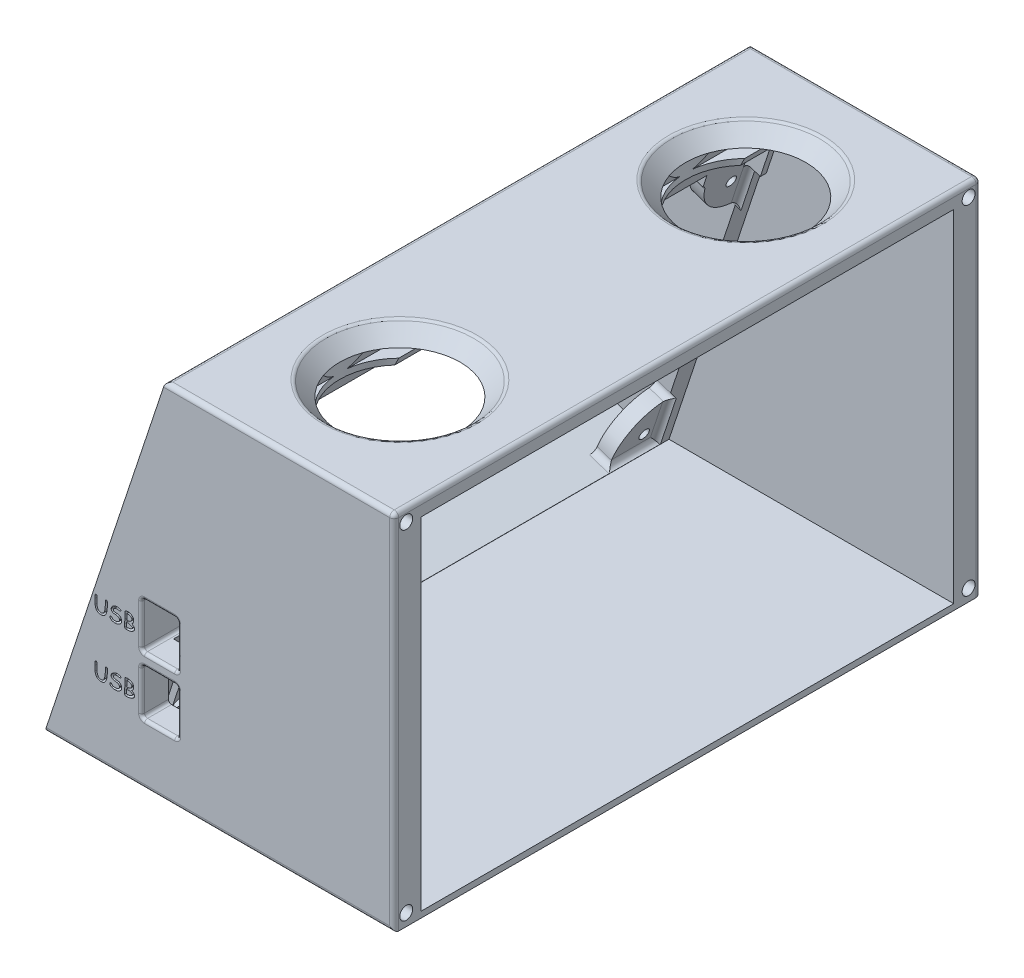
from build123d import *

# Parameters (mm, degrees)
BOSS_EXTRUDE1_DEPTH = 195
SKETCH2_W           = 76.2
SKETCH2_H           = 120.536301586
BOSS_EXTRUDE2_DEPTH = 195
SKETCH3_W           = 165.1
SKETCH3_H           = 102.1
CUT_EXTRUDE1_DEPTH  = 25.08
SKETCH7_R           = 1.7
BOSS_EXTRUDE3_DEPTH = 5
CUT_EXTRUDE3_REACH  = 243.579
FILLET1_R           = 2
BOSS_EXTRUDE4_DEPTH = 14.95
SKETCH10_W          = 12
SKETCH10_H          = 15.24
CUT_EXTRUDE4_DEPTH  = 14.95
FILLET2_R           = 1
SKETCH13_R          = 20
CUT_EXTRUDE5_DEPTH  = 20
CHAMFER2_SIZE       = 5
BOSS_EXTRUDE5_DEPTH = 14.95
SKETCH17_R          = 2.15
CUT_EXTRUDE6_DEPTH  = 8
FILLET3_R           = 1.5
SKETCH28_W          = 165.1
SKETCH28_H          = 2
CUT_EXTRUDE13_DEPTH = 14.8
CUT_EXTRUDE14_REACH = 259.014
SKETCH29_W          = 161.1
SKETCH29_H          = 10
CUT_EXTRUDE15_REACH = 259.014
SKETCH30_W          = 133.13999014
SKETCH30_H          = 4
CUT_EXTRUDE16_DEPTH = 4
CUT_EXTRUDE17_REACH = 259.014
SKETCH32_W          = 177.1
SKETCH32_H          = 113.536301586
SKETCH32_W_2        = 165.1
SKETCH32_H_2        = 107.536301586


with BuildPart() as part:
    # Sketch1 → Boss-Extrude1 (new body)
    with BuildSketch(Plane.XY):
        Polygon((0, 0), (-40, 0), (0, 120.536301586), align=None)
    extrude(amount=-BOSS_EXTRUDE1_DEPTH)

    # Sketch2 → Boss-Extrude2 (add)
    with BuildSketch(Plane.XY):
        with Locations((38.1, 60.268150793)):
            Rectangle(SKETCH2_W, SKETCH2_H)
    extrude(amount=-BOSS_EXTRUDE2_DEPTH)

    # Sketch3 → Cut-Extrude1 (cut)
    with BuildSketch(Plane(origin=(-36.031992064, 11.957225032, 0), x_dir=(0, 0, 1), z_dir=(-0.9491047368966206, 0.3149606299212598, 0))):
        with Locations((-97.5, 50.901574803)):
            Rectangle(SKETCH3_W, SKETCH3_H)
    extrude(amount=-CUT_EXTRUDE1_DEPTH, mode=Mode.SUBTRACT)

    # Sketch7 → Boss-Extrude3 (add)
    # profile 1 of 4: a face of its own
    with BuildSketch(Plane(origin=(-21.985241958, 7.295807709, 0), x_dir=(0, 0, 1), z_dir=(-0.9491047368966206, 0.3149606299212598, 0))):
        with BuildLine():
            Line((-180.05, 86.951574803), (-180.05, 101.951574803))
            Line((-180.05, 101.951574803), (-165.05, 101.951574803))
            ThreePointArc((-165.05, 101.951574803), (-169.443398282, 91.344973085), (-180.05, 86.951574803))
        make_face()
        with Locations(Location((-175, 96.901574803, 0), (0, 0, 270))):
            Circle(SKETCH7_R, mode=Mode.SUBTRACT)
    # profile 2 of 4: a face of its own
    with BuildSketch(Plane(origin=(-21.985241958, 7.295807709, 0), x_dir=(0, 0, 1), z_dir=(-0.9491047368966206, 0.3149606299212598, 0))):
        with BuildLine():
            Line((-14.95, 101.951574803), (-29.95, 101.951574803))
            ThreePointArc((-29.95, 101.951574803), (-25.556601718, 91.344973085), (-14.95, 86.951574803))
            Line((-14.95, 86.951574803), (-14.95, 101.951574803))
        make_face()
        with Locations(Location((-20, 96.901574803, 0), (0, 0, 90))):
            Circle(SKETCH7_R, mode=Mode.SUBTRACT)
    # profile 3 of 4: a face of its own
    with BuildSketch(Plane(origin=(-21.985241958, 7.295807709, 0), x_dir=(0, 0, 1), z_dir=(-0.9491047368966206, 0.3149606299212598, 0))):
        with BuildLine():
            Line((-14.95, 14.851574803), (-14.95, -0.148425197))
            Line((-14.95, -0.148425197), (-29.95, -0.148425197))
            ThreePointArc((-29.95, -0.148425197), (-25.556601718, 10.458176521), (-14.95, 14.851574803))
        make_face()
        with Locations(Location((-20, 4.901574803, 0), (0, 0, 270))):
            Circle(SKETCH7_R, mode=Mode.SUBTRACT)
    # profile 4 of 4: a face of its own
    with BuildSketch(Plane(origin=(-21.985241958, 7.295807709, 0), x_dir=(0, 0, 1), z_dir=(-0.9491047368966206, 0.3149606299212598, 0))):
        with BuildLine():
            Line((-180.05, -0.148425197), (-165.05, -0.148425197))
            ThreePointArc((-165.05, -0.148425197), (-169.443398282, 10.458176521), (-180.05, 14.851574803))
            Line((-180.05, 14.851574803), (-180.05, -0.148425197))
        make_face()
        with Locations(Location((-175, 4.901574803, 0), (0, 0, 90))):
            Circle(SKETCH7_R, mode=Mode.SUBTRACT)
    extrude(amount=-BOSS_EXTRUDE3_DEPTH)

    # Cut-Extrude3: up to this face of the body (flat: up to its plane)
    cut_extrude3_end = Plane(part.part.faces().sort_by_distance((27.406999307, 56.091563766, -195))[0])
    # Sketch8 → Cut-Extrude3 (cut, up to the picked face)
    with BuildSketch(Plane.XY, mode=Mode.PRIVATE) as cut_extrude3_sk1:
        Polygon((-11.915846467, 5), (76.2, 5), (76.2, 112.536301586), (23.770100478, 112.536301586), align=None)
    cut_extrude3_tool1 = split(extrude(cut_extrude3_sk1.sketch, amount=-CUT_EXTRUDE3_REACH, mode=Mode.PRIVATE), bisect_by=cut_extrude3_end, keep=Keep.BOTH, mode=Mode.PRIVATE)
    add(cut_extrude3_tool1.solids().sort_by(Axis((40.308479, 54.217397, 0), (0, 0, -1)))[0], mode=Mode.SUBTRACT)

    # Fillet1
    fillet1_edges = [part.edges().sort_by_distance(p)[0] for p in [
        (-14.924261643, 12.698419029, -180.05),
        (-14.93481876, 20.60410613, -180.05),
        (-17.286466367, 5.580133502, -172.55),
        (-19.659228209, 6.367535077, -165.05),
        (-17.286466367, 5.580133502, -22.45),
        (-19.659228209, 6.367535077, -29.95),
        (-14.924261643, 12.698419029, -14.95),
        (-14.93481876, 20.60410613, -14.95),
        (12.508809224, 95.365441612, -14.95),
        (7.773842657, 89.03455766, -14.95),
        (14.871013948, 102.483727139, -22.45),
        (12.498252106, 103.271128714, -29.95),
        (12.498252106, 103.271128714, -165.05),
        (12.508809224, 95.365441612, -180.05),
        (7.773842657, 89.03455766, -180.05),
        (14.871013948, 102.483727139, -172.55),
    ]]
    fillet(fillet1_edges, radius=FILLET1_R)

    # Sketch9 → Boss-Extrude4 (add)
    with BuildSketch(Plane.XY):
        Polygon((76.2, 112.536301586), (23.770100478, 112.536301586), (-11.915846467, 5), (76.2, 5), align=None)
    extrude(amount=-BOSS_EXTRUDE4_DEPTH)

    # Sketch10 → Cut-Extrude4 (cut)
    with BuildSketch(Plane.XY):
        with Locations((-1.8, 46.86)):
            Rectangle(SKETCH10_W, SKETCH10_H)
        with Locations((-1.8, 27.62)):
            Rectangle(SKETCH10_W, SKETCH10_H)
    extrude(amount=-CUT_EXTRUDE4_DEPTH, mode=Mode.SUBTRACT)

    # Fillet2
    fillet2_edges = [part.edges().sort_by_distance(p)[0] for p in [
        (-7.8, 39.24, -7.475),
        (-7.8, 54.48, -7.475),
        (4.2, 54.48, -7.475),
        (4.2, 39.24, -7.475),
        (-7.8, 46.86, 0),
        (-1.8, 39.24, 0),
        (4.2, 46.86, 0),
        (-1.8, 54.48, 0),
        (-7.8, 46.86, -14.95),
        (-1.8, 54.48, -14.95),
        (4.2, 46.86, -14.95),
        (-1.8, 39.24, -14.95),
        (-7.8, 20, -7.475),
        (-7.8, 35.24, -7.475),
        (4.2, 35.24, -7.475),
        (4.2, 20, -7.475),
        (-7.8, 27.62, 0),
        (-1.8, 20, 0),
        (4.2, 27.62, 0),
        (-1.8, 35.24, 0),
        (-7.8, 27.62, -14.95),
        (-1.8, 35.24, -14.95),
        (4.2, 27.62, -14.95),
        (-1.8, 20, -14.95),
    ]]
    fillet(fillet2_edges, radius=FILLET2_R)

    # Sketch13 → Cut-Extrude5 (cut)
    with BuildSketch(Plane(origin=(0, 120.536301586, 0), x_dir=(1, 0, 0), z_dir=(0, 1, 0))):
        with Locations(Location((38.1, 155, 0), (0, 0, 270))):
            Circle(SKETCH13_R)
        with Locations(Location((38.1, 40, 0), (0, 0, 270))):
            Circle(SKETCH13_R)
    extrude(amount=-CUT_EXTRUDE5_DEPTH, mode=Mode.SUBTRACT)

    # Chamfer2
    chamfer2_edges = [part.edges().sort_by_distance(p)[0] for p in [
        (38.1, 120.536301586, -175),
        (38.1, 120.536301586, -60),
    ]]
    chamfer(chamfer2_edges, length=CHAMFER2_SIZE)

    # Sketch15 → Boss-Extrude5 (add)
    with BuildSketch(Plane(origin=(0, 0, -195), x_dir=(-1, 0, 0), z_dir=(0, 0, -1))):
        Polygon((-76.2, 112.536301586), (-23.770100478, 112.536301586), (11.915846467, 5), (-76.2, 5), align=None)
    extrude(amount=-BOSS_EXTRUDE5_DEPTH)

    # Sketch17 → Cut-Extrude6 (cut)
    with BuildSketch(Plane(origin=(76.2, 0, 0), x_dir=(0, 0, -1), z_dir=(1, 0, 0))):
        with Locations(Location((4, 116.536301586, 0), (0, 0, 90))):
            Circle(SKETCH17_R)
        with Locations(Location((191, 116.536301586, 0), (0, 0, 90))):
            Circle(SKETCH17_R)
        with Locations(Location((191, 4, 0), (0, 0, 90))):
            Circle(SKETCH17_R)
        with Locations(Location((4, 4, 0), (0, 0, 90))):
            Circle(SKETCH17_R)
    extrude(amount=-CUT_EXTRUDE6_DEPTH, mode=Mode.SUBTRACT)

    # Fillet3
    fillet3_edges = [part.edges().sort_by_distance(p)[0] for p in [
        (76.2, 60.268150793, 0),
        (38.1, 120.536301586, 0),
        (18.1, 0, -195),
        (76.2, 60.268150793, -195),
        (76.2, 120.536301586, -97.5),
        (38.1, 120.536301586, -195),
        (38.1, 120.536301586, -180),
        (38.1, 120.536301586, -65),
        (18.1, 0, 0),
        (0, 120.536301586, -97.5),
    ]]
    fillet(fillet3_edges, radius=FILLET3_R)

    # Sketch28 → Cut-Extrude13 (cut)
    with BuildSketch(Plane(origin=(-36.031992064, 11.957225032, 0), x_dir=(0, 0, 1), z_dir=(-0.9491047368966206, 0.31496062992125995, 0))):
        with Locations((-97.5, 102.951574803)):
            Rectangle(SKETCH28_W, SKETCH28_H)
    extrude(amount=-CUT_EXTRUDE13_DEPTH, mode=Mode.SUBTRACT)

    # Cut-Extrude14: up to this face of the body (flat: up to its plane)
    cut_extrude14_end = Plane(part.part.faces().sort_by_distance((12.534119058, 95.441710457, -172.630358723))[0])
    # Sketch29 → Cut-Extrude14 (cut, up to the picked face)
    with BuildSketch(Plane(origin=(76.2, 0, 0), x_dir=(0, 0, -1), z_dir=(1, 0, 0)), mode=Mode.PRIVATE) as cut_extrude14_sk1:
        with Locations((97.5, 105.585517665)):
            Rectangle(SKETCH29_W, SKETCH29_H)
    cut_extrude14_tool1 = split(extrude(cut_extrude14_sk1.sketch, amount=-CUT_EXTRUDE14_REACH, mode=Mode.PRIVATE), bisect_by=cut_extrude14_end, keep=Keep.BOTH, mode=Mode.PRIVATE)
    add(cut_extrude14_tool1.solids().sort_by(Axis((76.2, 105.585518, -97.5), (-1, 0, 0)))[0], mode=Mode.SUBTRACT)

    # Cut-Extrude15: up to this plane
    cut_extrude15_end = Plane(origin=(10.125490264, 104.058530289, -14.95), z_dir=(-0.9491047368966206, 0.3149606299212598, 0))
    # Sketch30 → Cut-Extrude15 (cut, up to the surface)
    with BuildSketch(Plane(origin=(76.2, 0, 0), x_dir=(0, 0, -1), z_dir=(1, 0, 0)), mode=Mode.PRIVATE) as cut_extrude15_sk1:
        with Locations((97.5, 104.279744773)):
            Rectangle(SKETCH30_W, SKETCH30_H)
    cut_extrude15_tool1 = split(extrude(cut_extrude15_sk1.sketch, amount=-CUT_EXTRUDE15_REACH, mode=Mode.PRIVATE), bisect_by=cut_extrude15_end, keep=Keep.BOTH, mode=Mode.PRIVATE)
    add(cut_extrude15_tool1.solids().sort_by_distance((76.2, 104.279745, -97.5))[0], mode=Mode.SUBTRACT)

    # Sketch31 → Cut-Extrude16 (cut)
    # profile 1 of 6: a face of its own
    with BuildSketch(Plane.XY):
        with BuildLine():
            add(Edge.make_bspline(
                [(-21.185742187, 43.115), (-21.270144598, 43.116383354), (-21.43392581, 43.119067726), (-21.671044257, 43.148431182), (-21.891969194, 43.193373705), (-22.096479324, 43.25767708), (-22.28428792, 43.341345575), (-22.456698467, 43.441707645), (-22.611840133, 43.562396798), (-22.700877318, 43.65676933), (-22.7453125, 43.703867187)],
                knots=[0, 0, 0, 0, 1.177161856, 2.284259359, 3.328332965, 4.319550706, 5.26915988, 6.191523371, 7.097455876, 8, 8, 8, 8], degree=3))
            add(Edge.make_bspline(
                [(-22.7453125, 43.703867187), (-22.779392629, 43.74520581), (-22.848710196, 43.829286851), (-22.938240462, 43.970542585), (-23.018218963, 44.125245135), (-23.088601654, 44.294146095), (-23.148853859, 44.477069329), (-23.199067868, 44.674277624), (-23.241829421, 44.885018669), (-23.260264847, 45.03119041), (-23.269726562, 45.106210937)],
                knots=[0, 0, 0, 0, 0.845494785, 1.719701259, 2.634898822, 3.593542681, 4.606418135, 5.67382813, 6.806126011, 8, 8, 8, 8], degree=3))
            add(Edge.make_bspline(
                [(-23.269726562, 45.106210937), (-23.273903546, 45.145250134), (-23.283183707, 45.231984989), (-23.291882367, 45.37569053), (-23.301045217, 45.545262805), (-23.307229019, 45.740957406), (-23.313390954, 45.962626393), (-23.317066705, 46.210366568), (-23.318764128, 46.484138071), (-23.319267822, 46.67522111), (-23.31953125, 46.77515625)],
                knots=[0, 0, 0, 0, 0.564067355, 1.253209709, 2.068136242, 3.004155688, 4.066258464, 5.254423027, 6.56408176, 8, 8, 8, 8], degree=3))
            add(Edge.make_bspline(
                [(-23.31953125, 46.77515625), (-23.319480719, 46.848401866), (-23.319384815, 46.987418009), (-23.315030656, 47.184684674), (-23.310079253, 47.35957089), (-23.303203653, 47.468528557), (-23.3, 47.519296875)],
                knots=[0, 0, 0, 0, 1.180491632, 2.240508083, 3.180172925, 4, 4, 4, 4], degree=3))
            add(Edge.make_bspline(
                [(-23.3, 47.519296875), (-23.296400841, 47.565553761), (-23.289775472, 47.650703935), (-23.276442333, 47.766722661), (-23.261387779, 47.860475567), (-23.245437278, 47.91393584), (-23.238476562, 47.937265625)],
                knots=[0, 0, 0, 0, 1.31474729, 2.420200989, 3.310583915, 4, 4, 4, 4], degree=3))
            add(Edge.make_bspline(
                [(-23.238476562, 47.937265625), (-23.231194479, 47.95638402), (-23.217206669, 47.993107639), (-23.188550032, 48.042295535), (-23.155859776, 48.083809533), (-23.119988105, 48.119263504), (-23.077480342, 48.144143544), (-23.032441359, 48.164913721), (-22.98174375, 48.175027652), (-22.946840993, 48.176660806), (-22.92890625, 48.1775)],
                knots=[0, 0, 0, 0, 1.162962616, 2.233879786, 3.223499936, 4.167131869, 5.082324589, 6.011661019, 6.978294212, 8, 8, 8, 8], degree=3))
            add(Edge.make_bspline(
                [(-22.92890625, 48.1775), (-22.903897968, 48.175989012), (-22.855587764, 48.173070135), (-22.788702785, 48.145311204), (-22.732389504, 48.099869011), (-22.687446821, 48.036584837), (-22.653721623, 47.955759936), (-22.628863423, 47.858798138), (-22.614888804, 47.744305515), (-22.613331677, 47.66256481), (-22.6125, 47.61890625)],
                knots=[0, 0, 0, 0, 0.830709536, 1.604738233, 2.369271165, 3.215995175, 4.163827482, 5.274868405, 6.544478904, 8, 8, 8, 8], degree=3))
            Line((-22.6125, 47.61890625), (-22.6125, 45.679453125))
            add(Edge.make_bspline(
                [(-22.6125, 45.679453125), (-22.611390794, 45.598691556), (-22.609241465, 45.442198443), (-22.592280791, 45.21500508), (-22.56596592, 45.003165405), (-22.526828644, 44.807074805), (-22.477337261, 44.626744973), (-22.417252358, 44.461598535), (-22.344816412, 44.312424605), (-22.261475786, 44.178166285), (-22.166830426, 44.059355933), (-22.060324429, 43.956750274), (-21.943159584, 43.870032687), (-21.814842622, 43.79898614), (-21.675187954, 43.744355933), (-21.52439734, 43.70542093), (-21.362602857, 43.681674709), (-21.250929396, 43.67891689), (-21.193554687, 43.6775)],
                knots=[0, 0, 0, 0, 1.388678608, 2.690866957, 3.915675823, 5.05742226, 6.126264143, 7.12870541, 8.075060477, 8.972834271, 9.840955827, 10.680263421, 11.508767457, 12.340649728, 13.195127875, 14.08038853, 15.013757177, 16, 16, 16, 16], degree=3))
            add(Edge.make_bspline(
                [(-21.193554687, 43.6775), (-21.139570766, 43.67966161), (-21.033292593, 43.683917173), (-20.879932937, 43.726050039), (-20.736735261, 43.792322383), (-20.6043697, 43.885507727), (-20.484721441, 44.006322784), (-20.374534446, 44.151803367), (-20.27542367, 44.323994143), (-20.187226056, 44.522269622), (-20.109344264, 44.746126195), (-20.042872424, 44.996049308), (-19.985466842, 45.271832853), (-19.93915399, 45.574050088), (-19.903818416, 45.902226593), (-19.877537387, 46.256570715), (-19.861964763, 46.636994081), (-19.860385244, 46.899490329), (-19.859570312, 47.034921875)],
                knots=[0, 0, 0, 0, 0.654988698, 1.28947658, 1.918000293, 2.565752122, 3.245739785, 3.977081776, 4.778670402, 5.655429898, 6.611639286, 7.657057912, 8.797197977, 10.034689408, 11.372401622, 12.808946828, 14.353617359, 16, 16, 16, 16], degree=3))
            add(Edge.make_bspline(
                [(-19.859570312, 47.034921875), (-19.859570312, 47.057382812), (-19.859570312, 47.105234375), (-19.859570312, 47.18140625), (-19.859570312, 47.266692708), (-19.859570312, 47.326588542), (-19.859570312, 47.358164062)],
                knots=[0, 0, 0, 0, 0.833836858, 1.776435045, 2.827794562, 4, 4, 4, 4], degree=3))
            add(Edge.make_bspline(
                [(-19.859570312, 47.358164062), (-19.859895666, 47.388437519), (-19.860483411, 47.443125813), (-19.861279788, 47.51702124), (-19.86268351, 47.574305529), (-19.862553895, 47.607187028), (-19.8625, 47.620859375)],
                knots=[0, 0, 0, 0, 1.3828741, 2.498129804, 3.375512313, 4, 4, 4, 4], degree=3))
            add(Edge.make_bspline(
                [(-19.8625, 47.620859375), (-19.861499367, 47.653781173), (-19.859538754, 47.718287298), (-19.846130192, 47.811745712), (-19.822633299, 47.899297081), (-19.799651549, 47.953444671), (-19.78828125, 47.980234375)],
                knots=[0, 0, 0, 0, 1.06819056, 2.092985094, 3.05649793, 4, 4, 4, 4], degree=3))
            add(Edge.make_bspline(
                [(-19.78828125, 47.980234375), (-19.772072914, 48.009798861), (-19.741544428, 48.065483728), (-19.67662236, 48.131558673), (-19.596625752, 48.170417994), (-19.53934093, 48.175099149), (-19.509960937, 48.1775)],
                knots=[0, 0, 0, 0, 1.116671007, 2.103255758, 3.027205966, 4, 4, 4, 4], degree=3))
            add(Edge.make_bspline(
                [(-19.509960937, 48.1775), (-19.483746866, 48.176421849), (-19.433580849, 48.174358584), (-19.36359949, 48.152245976), (-19.303883004, 48.116406466), (-19.255525336, 48.065279814), (-19.218371995, 48.000310423), (-19.192511291, 47.921641609), (-19.177052902, 47.829471742), (-19.175714593, 47.763504563), (-19.175, 47.72828125)],
                knots=[0, 0, 0, 0, 0.983280369, 1.881709253, 2.727978971, 3.576636912, 4.498538173, 5.520765694, 6.676207673, 8, 8, 8, 8], degree=3))
            add(Edge.make_bspline(
                [(-19.175, 47.72828125), (-19.175066652, 47.702890264), (-19.175214487, 47.646572647), (-19.173832643, 47.553478012), (-19.173005929, 47.4431254), (-19.172397153, 47.363697928), (-19.172070312, 47.321054687)],
                knots=[0, 0, 0, 0, 0.748177209, 1.659469165, 2.743409359, 4, 4, 4, 4], degree=3))
            add(Edge.make_bspline(
                [(-19.172070312, 47.321054687), (-19.172070312, 47.278411458), (-19.172070312, 47.199309896), (-19.172070312, 47.088958333), (-19.172070312, 46.996184896), (-19.172070312, 46.939869792), (-19.172070312, 46.914804687)],
                knots=[0, 0, 0, 0, 1.259615385, 2.336538462, 3.259615385, 4, 4, 4, 4], degree=3))
            add(Edge.make_bspline(
                [(-19.172070312, 46.914804687), (-19.172435727, 46.837001517), (-19.173155958, 46.683651321), (-19.179132299, 46.457374431), (-19.188821934, 46.238258125), (-19.202363484, 46.026612858), (-19.219981082, 45.822469984), (-19.24100867, 45.625693112), (-19.267893005, 45.43666415), (-19.296781182, 45.254525141), (-19.330023444, 45.079980148), (-19.366578682, 44.91267336), (-19.409275713, 44.753420739), (-19.453643415, 44.601064487), (-19.50236812, 44.455896506), (-19.556284685, 44.318717522), (-19.612633247, 44.188430274), (-19.673212965, 44.065653196), (-19.738748164, 43.950974517), (-19.807007906, 43.84249619), (-19.880358821, 43.742516653), (-19.95636464, 43.648724397), (-20.037977266, 43.563854663), (-20.122626685, 43.485717842), (-20.211230677, 43.414680614), (-20.303856385, 43.35120628), (-20.400613917, 43.295582326), (-20.501168954, 43.247341378), (-20.605507725, 43.206170263), (-20.71411815, 43.173449905), (-20.826152536, 43.14645488), (-20.94240776, 43.128227709), (-21.062814373, 43.117419219), (-21.144378635, 43.115814034), (-21.185742187, 43.115)],
                knots=[0, 0, 0, 0, 1.554006229, 3.062949189, 4.520823245, 5.934666764, 7.298592302, 8.613277126, 9.886801467, 11.111782478, 12.296429775, 13.43537467, 14.531439907, 15.588911977, 16.604622979, 17.588666434, 18.53206811, 19.439285719, 20.321556559, 21.169299358, 21.997722876, 22.796926619, 23.578723185, 24.347185027, 25.09656845, 25.844992247, 26.587746085, 27.323494678, 28.070872775, 28.825680372, 29.58740119, 30.370926203, 31.173850445, 32, 32, 32, 32], degree=3))
        make_face()
    # profile 2 of 6: a face of its own
    with BuildSketch(Plane.XY):
        with BuildLine():
            add(Edge.make_bspline(
                [(-18.3625, 44.054453125), (-18.361882595, 44.076397381), (-18.360689547, 44.118801588), (-18.342180714, 44.179315884), (-18.311136448, 44.233383922), (-18.26791997, 44.279705645), (-18.216048623, 44.318118162), (-18.157208838, 44.345430094), (-18.092507296, 44.361546218), (-18.047815592, 44.363819563), (-18.024609375, 44.365)],
                knots=[0, 0, 0, 0, 1.020978776, 1.972898741, 2.919100688, 3.908607674, 4.908561358, 5.914730999, 6.917221763, 8, 8, 8, 8], degree=3))
            add(Edge.make_bspline(
                [(-18.024609375, 44.365), (-17.997831926, 44.363101964), (-17.9436453, 44.359261115), (-17.867446907, 44.321256455), (-17.796188764, 44.264211936), (-17.757892815, 44.213365229), (-17.7375, 44.186289062)],
                knots=[0, 0, 0, 0, 0.907817167, 1.837051385, 2.848217297, 4, 4, 4, 4], degree=3))
            add(Edge.make_bspline(
                [(-17.7375, 44.186289062), (-17.710589355, 44.148845777), (-17.660198181, 44.078731846), (-17.583564959, 43.985844569), (-17.511533429, 43.91133881), (-17.460947266, 43.873570951), (-17.437695312, 43.856210937)],
                knots=[0, 0, 0, 0, 1.23447497, 2.31159988, 3.223926103, 4, 4, 4, 4], degree=3))
            add(Edge.make_bspline(
                [(-17.437695312, 43.856210937), (-17.413243119, 43.841657631), (-17.363087983, 43.811806604), (-17.280056535, 43.776553811), (-17.190335597, 43.744646736), (-17.091959608, 43.721064533), (-16.986028482, 43.701514806), (-16.872305661, 43.686669535), (-16.750292079, 43.679383774), (-16.666544343, 43.678142043), (-16.623242187, 43.6775)],
                knots=[0, 0, 0, 0, 0.807895578, 1.657115672, 2.558318706, 3.511992341, 4.528196508, 5.619539607, 6.769171901, 8, 8, 8, 8], degree=3))
            add(Edge.make_bspline(
                [(-16.623242187, 43.6775), (-16.580912037, 43.678423212), (-16.49712021, 43.680250694), (-16.37244394, 43.689612926), (-16.250376365, 43.707935685), (-16.129808381, 43.730711981), (-16.011801774, 43.762128182), (-15.896399382, 43.800823509), (-15.782521561, 43.843782587), (-15.709576406, 43.879393368), (-15.673046875, 43.897226562)],
                knots=[0, 0, 0, 0, 1.032504842, 2.043826106, 3.046385216, 4.04124581, 5.034838662, 6.021429811, 7.009170089, 8, 8, 8, 8], degree=3))
            add(Edge.make_bspline(
                [(-15.673046875, 43.897226562), (-15.628556054, 43.921041512), (-15.543269349, 43.966693591), (-15.428282417, 44.047698312), (-15.331287306, 44.135655983), (-15.250062253, 44.229846543), (-15.189476009, 44.332891362), (-15.144385841, 44.44177991), (-15.117419981, 44.558034755), (-15.114154529, 44.637973475), (-15.1125, 44.678476562)],
                knots=[0, 0, 0, 0, 1.189786699, 2.280762261, 3.308288894, 4.272931975, 5.202800241, 6.115543574, 7.045189811, 8, 8, 8, 8], degree=3))
            add(Edge.make_bspline(
                [(-15.1125, 44.678476562), (-15.114103604, 44.712116042), (-15.117251104, 44.778142468), (-15.139184064, 44.874670649), (-15.17675242, 44.965292295), (-15.229613737, 45.05029933), (-15.296664442, 45.129901749), (-15.378781263, 45.203326168), (-15.47538359, 45.27109993), (-15.546957852, 45.309746037), (-15.584179687, 45.32984375)],
                knots=[0, 0, 0, 0, 0.949240243, 1.863136486, 2.777725302, 3.705920659, 4.677662452, 5.705515345, 6.80676479, 8, 8, 8, 8], degree=3))
            add(Edge.make_bspline(
                [(-15.584179687, 45.32984375), (-15.618102302, 45.346700773), (-15.686746986, 45.380812088), (-15.796083, 45.421886583), (-15.910277546, 45.459365206), (-16.030560141, 45.490672918), (-16.157186701, 45.514944474), (-16.289608732, 45.532804439), (-16.42764339, 45.547428412), (-16.521641612, 45.55078825), (-16.56953125, 45.5525)],
                knots=[0, 0, 0, 0, 0.891996852, 1.805015421, 2.748548653, 3.723361584, 4.731199176, 5.784448007, 6.871234155, 8, 8, 8, 8], degree=3))
            add(Edge.make_bspline(
                [(-16.56953125, 45.5525), (-16.612207477, 45.554658465), (-16.696106871, 45.558901902), (-16.81932085, 45.572786585), (-16.937668954, 45.592204406), (-17.05121655, 45.617408599), (-17.15985712, 45.649215875), (-17.264464953, 45.684464137), (-17.363576631, 45.727669689), (-17.42619413, 45.761379691), (-17.457226562, 45.778085937)],
                knots=[0, 0, 0, 0, 1.109083175, 2.180403794, 3.216792943, 4.22137708, 5.197588291, 6.154329841, 7.085309469, 8, 8, 8, 8], degree=3))
            add(Edge.make_bspline(
                [(-17.457226562, 45.778085937), (-17.494257845, 45.800350707), (-17.566440613, 45.843750034), (-17.662273258, 45.921196717), (-17.743960473, 46.005834005), (-17.809235922, 46.098572059), (-17.862770192, 46.196986732), (-17.897961909, 46.303906317), (-17.92195548, 46.417315827), (-17.923968636, 46.49572729), (-17.925, 46.535898437)],
                knots=[0, 0, 0, 0, 1.104423339, 2.152783505, 3.142433753, 4.103820206, 5.046408413, 5.997202751, 6.973942584, 8, 8, 8, 8], degree=3))
            add(Edge.make_bspline(
                [(-17.925, 46.535898437), (-17.922839457, 46.583911724), (-17.91850257, 46.680289434), (-17.886119684, 46.822480902), (-17.833336332, 46.961343721), (-17.759582551, 47.096820069), (-17.662873704, 47.227678625), (-17.54873721, 47.357429695), (-17.411176152, 47.48182871), (-17.309110762, 47.558528184), (-17.256054687, 47.598398437)],
                knots=[0, 0, 0, 0, 0.882315765, 1.771084206, 2.667078851, 3.607169967, 4.597299244, 5.653059042, 6.780002939, 8, 8, 8, 8], degree=3))
            add(Edge.make_bspline(
                [(-17.256054687, 47.598398437), (-17.20319986, 47.634716967), (-17.09914143, 47.706219408), (-16.93626428, 47.797496837), (-16.772970059, 47.876112883), (-16.608386888, 47.941223724), (-16.442086679, 47.991233638), (-16.274432591, 48.026076815), (-16.105641405, 48.048869954), (-15.992455537, 48.05128827), (-15.935742187, 48.0525)],
                knots=[0, 0, 0, 0, 1.084105602, 2.134342923, 3.153783451, 4.147494286, 5.124611481, 6.086661538, 7.041295226, 8, 8, 8, 8], degree=3))
            add(Edge.make_bspline(
                [(-15.935742187, 48.0525), (-15.88035606, 48.051005292), (-15.766014864, 48.047919561), (-15.589407911, 48.027563703), (-15.403008002, 47.993069444), (-15.276404265, 47.961403649), (-15.211132812, 47.945078125)],
                knots=[0, 0, 0, 0, 0.904920533, 1.868151822, 2.900910592, 4, 4, 4, 4], degree=3))
            add(Edge.make_bspline(
                [(-15.211132812, 47.945078125), (-15.168984356, 47.933548478), (-15.089885065, 47.911910986), (-14.980495481, 47.873669757), (-14.887437402, 47.833660558), (-14.811343392, 47.789707568), (-14.751504179, 47.743953051), (-14.707358671, 47.695889145), (-14.680846192, 47.643087501), (-14.676914315, 47.606463808), (-14.675, 47.588632812)],
                knots=[0, 0, 0, 0, 1.536451653, 2.883432639, 4.072626447, 5.093694848, 5.966289869, 6.712663879, 7.373234022, 8, 8, 8, 8], degree=3))
            add(Edge.make_bspline(
                [(-14.675, 47.588632812), (-14.675845136, 47.566078386), (-14.677431049, 47.523754616), (-14.691528637, 47.464604379), (-14.713330115, 47.413526646), (-14.746929783, 47.371899783), (-14.790183626, 47.340298719), (-14.842101182, 47.317501175), (-14.903299088, 47.305376475), (-14.946759033, 47.303500068), (-14.969921875, 47.3025)],
                knots=[0, 0, 0, 0, 1.147274365, 2.152880138, 3.080677453, 3.953489691, 4.842381196, 5.785320622, 6.819642577, 8, 8, 8, 8], degree=3))
            add(Edge.make_bspline(
                [(-14.969921875, 47.3025), (-14.995998022, 47.303391706), (-15.0565174, 47.30546124), (-15.159222996, 47.320364586), (-15.28678809, 47.338793261), (-15.430795896, 47.367305907), (-15.577819017, 47.395403255), (-15.71401361, 47.414776421), (-15.831995203, 47.427025758), (-15.904468572, 47.427350922), (-15.937695312, 47.4275)],
                knots=[0, 0, 0, 0, 0.64035602, 1.486183851, 2.545593541, 3.806237026, 5.090462414, 6.221050272, 7.184407993, 8, 8, 8, 8], degree=3))
            add(Edge.make_bspline(
                [(-15.937695312, 47.4275), (-15.979719621, 47.426059844), (-16.062316917, 47.423229269), (-16.183313402, 47.410315938), (-16.299556492, 47.390997059), (-16.410910831, 47.363701257), (-16.517773659, 47.328617827), (-16.619383338, 47.285274965), (-16.716660977, 47.235832439), (-16.777511932, 47.196890856), (-16.8078125, 47.1775)],
                knots=[0, 0, 0, 0, 1.098563762, 2.159188293, 3.177307101, 4.17590561, 5.152410848, 6.113039325, 7.060393052, 8, 8, 8, 8], degree=3))
            add(Edge.make_bspline(
                [(-16.8078125, 47.1775), (-16.836930743, 47.156947219), (-16.893369868, 47.117110305), (-16.968045652, 47.048931246), (-17.031488264, 46.977887276), (-17.084810846, 46.903846881), (-17.124624565, 46.825578494), (-17.153334959, 46.744154377), (-17.171810115, 46.659446183), (-17.173927445, 46.60142332), (-17.175, 46.57203125)],
                knots=[0, 0, 0, 0, 1.156832391, 2.242257832, 3.2758141, 4.246901468, 5.197449485, 6.117149032, 7.046222712, 8, 8, 8, 8], degree=3))
            add(Edge.make_bspline(
                [(-17.175, 46.57203125), (-17.173429111, 46.55036104), (-17.170295708, 46.507136144), (-17.146869781, 46.445027248), (-17.107075132, 46.388970879), (-17.051917504, 46.339099682), (-16.982445658, 46.294318403), (-16.898526553, 46.254185769), (-16.798894343, 46.220672285), (-16.726901918, 46.202679621), (-16.688671875, 46.193125)],
                knots=[0, 0, 0, 0, 0.779947725, 1.555737587, 2.356322645, 3.236265005, 4.218915667, 5.326038242, 6.580049603, 8, 8, 8, 8], degree=3))
            add(Edge.make_bspline(
                [(-16.688671875, 46.193125), (-16.671779089, 46.189364538), (-16.634926305, 46.181160831), (-16.573535426, 46.171892744), (-16.501903488, 46.162235832), (-16.419530964, 46.15249729), (-16.326746581, 46.142775569), (-16.223535725, 46.133196402), (-16.109654215, 46.123035975), (-16.030156022, 46.117764), (-15.988476562, 46.115)],
                knots=[0, 0, 0, 0, 0.588960752, 1.284858742, 2.112302552, 3.049675239, 4.108181828, 5.287978176, 6.578136203, 8, 8, 8, 8], degree=3))
            add(Edge.make_bspline(
                [(-15.988476562, 46.115), (-15.927483239, 46.109433237), (-15.808155053, 46.098542343), (-15.635248924, 46.066689997), (-15.4721212, 46.025087441), (-15.319290862, 45.971607655), (-15.177035648, 45.905625165), (-15.044455628, 45.829623559), (-14.922328508, 45.741489369), (-14.84916682, 45.674022989), (-14.812695312, 45.640390625)],
                knots=[0, 0, 0, 0, 1.134643475, 2.219832288, 3.254399288, 4.252361306, 5.2160512, 6.156708817, 7.081109121, 8, 8, 8, 8], degree=3))
            add(Edge.make_bspline(
                [(-14.812695312, 45.640390625), (-14.781748088, 45.60843442), (-14.720568833, 45.545260522), (-14.641598811, 45.44127045), (-14.57453841, 45.332003148), (-14.519555819, 45.217565466), (-14.477543229, 45.097571246), (-14.447269712, 44.972642625), (-14.42799532, 44.842488115), (-14.426007632, 44.753739769), (-14.425, 44.70875)],
                knots=[0, 0, 0, 0, 1.028307477, 2.03285068, 3.013053631, 3.989779647, 4.963831607, 5.94821947, 6.959877708, 8, 8, 8, 8], degree=3))
            add(Edge.make_bspline(
                [(-14.425, 44.70875), (-14.427244883, 44.645114647), (-14.431664506, 44.519832299), (-14.466780453, 44.337231477), (-14.523411469, 44.164143645), (-14.604649431, 44.001765674), (-14.708231592, 43.849209317), (-14.834716805, 43.706717412), (-14.983969829, 43.573981318), (-15.096595839, 43.497228744), (-15.154492187, 43.457773437)],
                knots=[0, 0, 0, 0, 1.006906322, 1.982350743, 2.932524148, 3.882138281, 4.847028019, 5.843859457, 6.891617794, 8, 8, 8, 8], degree=3))
            add(Edge.make_bspline(
                [(-15.154492187, 43.457773437), (-15.207751574, 43.425398914), (-15.314397405, 43.360572632), (-15.48278791, 43.277614391), (-15.658024533, 43.208325262), (-15.839342738, 43.151974353), (-16.026359566, 43.106131364), (-16.220149659, 43.076088849), (-16.419983185, 43.055149382), (-16.555477272, 43.053391727), (-16.62421875, 43.0525)],
                knots=[0, 0, 0, 0, 0.96740237, 1.93711262, 2.910412234, 3.890342931, 4.88332579, 5.897071892, 6.933101885, 8, 8, 8, 8], degree=3))
            add(Edge.make_bspline(
                [(-16.62421875, 43.0525), (-16.674370567, 43.053287593), (-16.773486216, 43.054844122), (-16.920761316, 43.066143527), (-17.064657255, 43.08295186), (-17.205324095, 43.109051048), (-17.34263245, 43.140921817), (-17.477061325, 43.180045201), (-17.60810653, 43.22684767), (-17.693092675, 43.263621895), (-17.735546875, 43.281992187)],
                knots=[0, 0, 0, 0, 1.052595361, 2.080257086, 3.098952793, 4.092052013, 5.081501202, 6.056668516, 7.029223139, 8, 8, 8, 8], degree=3))
            add(Edge.make_bspline(
                [(-17.735546875, 43.281992187), (-17.784258252, 43.305422758), (-17.877846035, 43.350439247), (-18.004431983, 43.431162639), (-18.113343798, 43.517304021), (-18.201018799, 43.6126499), (-18.272310664, 43.712601881), (-18.322338479, 43.820930772), (-18.355180604, 43.935386966), (-18.360045143, 44.014519453), (-18.3625, 44.054453125)],
                knots=[0, 0, 0, 0, 1.230486047, 2.364097874, 3.413457518, 4.384300228, 5.305970186, 6.198444544, 7.090857273, 8, 8, 8, 8], degree=3))
        make_face()
    # profile 3 of 6: a face of its own
    with BuildSketch(Plane.XY):
        with BuildLine():
            add(Edge.make_bspline(
                [(-11.161328125, 43.344492187), (-11.224211224, 43.32092269), (-11.352891722, 43.272691372), (-11.555595944, 43.213752376), (-11.770888882, 43.164244076), (-11.999042315, 43.123381911), (-12.239818876, 43.091203118), (-12.493683134, 43.069288803), (-12.759804896, 43.055360332), (-12.941583666, 43.053466653), (-13.034375, 43.0525)],
                knots=[0, 0, 0, 0, 0.845148608, 1.729465408, 2.654896534, 3.625080711, 4.646240167, 5.711756778, 6.831936531, 8, 8, 8, 8], degree=3))
            add(Edge.make_bspline(
                [(-13.034375, 43.0525), (-13.05770641, 43.054322147), (-13.104656709, 43.057988893), (-13.173680645, 43.08467522), (-13.240150365, 43.127287979), (-13.30175621, 43.18521907), (-13.354722331, 43.251051783), (-13.395302324, 43.320474183), (-13.420299376, 43.391972058), (-13.423450411, 43.440664051), (-13.425, 43.464609375)],
                knots=[0, 0, 0, 0, 0.905166651, 1.821486394, 2.83904999, 3.957846056, 5.091625874, 6.111309478, 7.071196234, 8, 8, 8, 8], degree=3))
            Line((-13.425, 43.464609375), (-13.425, 44.430429687))
            add(Edge.make_bspline(
                [(-13.425, 44.430429687), (-13.424733287, 44.472096975), (-13.424172753, 44.559666599), (-13.422065866, 44.697362232), (-13.419350447, 44.847767804), (-13.414461678, 45.010864146), (-13.406979051, 45.186272292), (-13.400788299, 45.374473575), (-13.391826586, 45.575319392), (-13.384718161, 45.713637027), (-13.381054687, 45.784921875)],
                knots=[0, 0, 0, 0, 0.737849974, 1.550694791, 2.438561872, 3.401627494, 4.439981643, 5.54745813, 6.736031923, 8, 8, 8, 8], degree=3))
            add(Edge.make_bspline(
                [(-13.381054687, 45.784921875), (-13.37705111, 45.861414498), (-13.369351503, 46.008523689), (-13.359788677, 46.221115319), (-13.351045394, 46.417405528), (-13.34285926, 46.597392063), (-13.337362377, 46.761156013), (-13.332022005, 46.908270032), (-13.329311958, 47.039148151), (-13.327969488, 47.120859077), (-13.32734375, 47.158945312)],
                knots=[0, 0, 0, 0, 1.336822694, 2.570952543, 3.714018919, 4.766024101, 5.715397503, 6.573729646, 7.335201894, 8, 8, 8, 8], degree=3))
            add(Edge.make_bspline(
                [(-13.32734375, 47.158945312), (-13.327404355, 47.185963759), (-13.327532871, 47.243257636), (-13.326444412, 47.333756658), (-13.324463302, 47.43369355), (-13.321516169, 47.542745208), (-13.317561488, 47.661235019), (-13.312679104, 47.788840662), (-13.306794721, 47.92588525), (-13.302316508, 48.020275176), (-13.3, 48.069101562)],
                knots=[0, 0, 0, 0, 0.712050298, 1.509935911, 2.385153873, 3.346337456, 4.384953733, 5.509610457, 6.71176165, 8, 8, 8, 8], degree=3))
            add(Edge.make_bspline(
                [(-13.3, 48.069101562), (-13.295668826, 48.094729808), (-13.287670507, 48.142057126), (-13.263943069, 48.204822529), (-13.233561328, 48.255641459), (-13.204409689, 48.277510523), (-13.190625, 48.287851562)],
                knots=[0, 0, 0, 0, 1.23418656, 2.279154888, 3.186278501, 4, 4, 4, 4], degree=3))
            add(Edge.make_bspline(
                [(-13.190625, 48.287851562), (-13.113165387, 48.30983597), (-12.954918251, 48.354749306), (-12.70509049, 48.395374091), (-12.44092772, 48.422974584), (-12.259389122, 48.425965073), (-12.166210937, 48.4275)],
                knots=[0, 0, 0, 0, 0.930556381, 1.901092399, 2.922695212, 4, 4, 4, 4], degree=3))
            add(Edge.make_bspline(
                [(-12.166210937, 48.4275), (-12.11764714, 48.426459138), (-12.020811979, 48.424383681), (-11.876397483, 48.4049139), (-11.733540982, 48.37392878), (-11.592422977, 48.329175953), (-11.452346279, 48.273808703), (-11.314251951, 48.204566657), (-11.17705222, 48.123928073), (-11.08956731, 48.061023581), (-11.045117187, 48.0290625)],
                knots=[0, 0, 0, 0, 0.962147252, 1.918500801, 2.882873772, 3.856291195, 4.84954284, 5.865236775, 6.91535024, 8, 8, 8, 8], degree=3))
            add(Edge.make_bspline(
                [(-11.045117187, 48.0290625), (-10.99582271, 47.990609823), (-10.90003766, 47.915891686), (-10.772834286, 47.790889769), (-10.665864815, 47.65870432), (-10.5777369, 47.519561891), (-10.508626624, 47.373811507), (-10.461032823, 47.220529397), (-10.430317382, 47.061214314), (-10.426788452, 46.952382318), (-10.425, 46.897226562)],
                knots=[0, 0, 0, 0, 1.117202605, 2.170857918, 3.180777677, 4.15128398, 5.109476991, 6.055661985, 7.014614856, 8, 8, 8, 8], degree=3))
            add(Edge.make_bspline(
                [(-10.425, 46.897226562), (-10.426957224, 46.827759059), (-10.430783641, 46.691948504), (-10.463819897, 46.494247002), (-10.517508626, 46.307879041), (-10.593396442, 46.132701398), (-10.690268481, 45.968486932), (-10.810392247, 45.817121815), (-10.950575187, 45.675924899), (-11.057741528, 45.594238871), (-11.1125, 45.5525)],
                knots=[0, 0, 0, 0, 1.058953792, 2.070278829, 3.047589135, 4.010504305, 4.974404593, 5.94679655, 6.95088062, 8, 8, 8, 8], degree=3))
            add(Edge.make_bspline(
                [(-11.1125, 45.5525), (-11.071995734, 45.534902465), (-10.992630722, 45.500421442), (-10.879012439, 45.444885388), (-10.77287296, 45.388324429), (-10.675317862, 45.329637258), (-10.585299198, 45.270129533), (-10.502768427, 45.209651232), (-10.428278685, 45.147121702), (-10.361853281, 45.082674254), (-10.303082014, 45.017124929), (-10.251471897, 44.950813936), (-10.209525791, 44.881581927), (-10.174114274, 44.81154146), (-10.146575314, 44.739893396), (-10.126850281, 44.666956504), (-10.114705055, 44.592296442), (-10.113238678, 44.54180297), (-10.1125, 44.516367187)],
                knots=[0, 0, 0, 0, 1.389510839, 2.722640191, 3.978357324, 5.172924784, 6.30364197, 7.373077171, 8.390833472, 9.361520877, 10.282794515, 11.15966198, 12.001175195, 12.825747472, 13.626629272, 14.411832578, 15.199970237, 16, 16, 16, 16], degree=3))
            add(Edge.make_bspline(
                [(-10.1125, 44.516367187), (-10.113931564, 44.48307975), (-10.11681853, 44.415950613), (-10.13681368, 44.315988526), (-10.170800845, 44.217105621), (-10.218004993, 44.119110607), (-10.279257972, 44.022350324), (-10.353335721, 43.92616352), (-10.439905015, 43.830437604), (-10.505522907, 43.770707782), (-10.539257812, 43.74)],
                knots=[0, 0, 0, 0, 0.874407195, 1.76337398, 2.666706198, 3.61537891, 4.614412331, 5.66984113, 6.80203881, 8, 8, 8, 8], degree=3))
            add(Edge.make_bspline(
                [(-10.539257812, 43.74), (-10.588322106, 43.697708219), (-10.684890856, 43.614469186), (-10.840030347, 43.507981033), (-10.997112843, 43.414964113), (-11.107057252, 43.367782181), (-11.161328125, 43.344492187)],
                knots=[0, 0, 0, 0, 1.04855267, 2.063770054, 3.044236175, 4, 4, 4, 4], degree=3))
        make_face()
        with BuildLine():
            add(Edge.make_bspline(
                [(-12.157421875, 47.74), (-12.214071814, 47.740085301), (-12.318608071, 47.740242706), (-12.461498828, 47.734716339), (-12.577597767, 47.729297691), (-12.645405343, 47.7211118), (-12.675, 47.717539062)],
                knots=[0, 0, 0, 0, 1.311143454, 2.419455882, 3.310170582, 4, 4, 4, 4], degree=3))
            Line((-12.675, 47.717539062), (-12.680859375, 47.159921875))
            Line((-12.680859375, 47.159921875), (-12.7375, 45.9275))
            add(Edge.make_bspline(
                [(-12.7375, 45.9275), (-12.700078906, 45.922188454), (-12.629837343, 45.912218373), (-12.531128165, 45.899766577), (-12.446489287, 45.889037256), (-12.375545578, 45.880134839), (-12.318574103, 45.873196613), (-12.275587405, 45.868792388), (-12.246684263, 45.86461769), (-12.231971196, 45.864899976), (-12.226757812, 45.865)],
                knots=[0, 0, 0, 0, 1.762393324, 3.308114521, 4.639196962, 5.740586565, 6.642425824, 7.314598078, 7.75713677, 8, 8, 8, 8], degree=3))
            add(Edge.make_bspline(
                [(-12.226757812, 45.865), (-12.185365311, 45.869125251), (-12.10424145, 45.8772102), (-11.985644976, 45.896448262), (-11.872645708, 45.92381284), (-11.765852964, 45.959150011), (-11.664105032, 45.999760771), (-11.569256377, 46.04943306), (-11.4789653, 46.10415063), (-11.423952175, 46.14731327), (-11.396679687, 46.168710937)],
                knots=[0, 0, 0, 0, 1.111640606, 2.178669459, 3.208442161, 4.215432668, 5.183209707, 6.132667044, 7.074278815, 8, 8, 8, 8], degree=3))
            add(Edge.make_bspline(
                [(-11.396679687, 46.168710937), (-11.369064226, 46.192838465), (-11.31467132, 46.240361347), (-11.244487984, 46.321202545), (-11.184309259, 46.406469531), (-11.13515184, 46.496929113), (-11.096699654, 46.59257407), (-11.0692371, 46.693463905), (-11.053747264, 46.799743814), (-11.051263907, 46.872112948), (-11.05, 46.908945312)],
                knots=[0, 0, 0, 0, 1.039321603, 2.047104005, 3.028387125, 3.995399141, 4.960910613, 5.946659751, 6.95494981, 8, 8, 8, 8], degree=3))
            add(Edge.make_bspline(
                [(-11.05, 46.908945312), (-11.051199438, 46.93442671), (-11.053607878, 46.985592713), (-11.071006385, 47.061177271), (-11.098319766, 47.13537787), (-11.13850946, 47.207021299), (-11.188690993, 47.277916966), (-11.25055152, 47.347025876), (-11.323569366, 47.414424163), (-11.40536872, 47.47986101), (-11.493508132, 47.540248489), (-11.58473374, 47.593169408), (-11.676746003, 47.638225714), (-11.769833456, 47.67597797), (-11.865107248, 47.704185297), (-11.961460809, 47.724412439), (-12.059051458, 47.738077824), (-12.124498267, 47.739356667), (-12.157421875, 47.74)],
                knots=[0, 0, 0, 0, 0.811227325, 1.628923975, 2.459084342, 3.322265874, 4.23721336, 5.221517372, 6.270705122, 7.399480973, 8.555739175, 9.670905582, 10.756115058, 11.817125015, 12.866978737, 13.916422681, 14.951837649, 16, 16, 16, 16], degree=3))
        make_face(mode=Mode.SUBTRACT)
        with BuildLine():
            Line((-11.782421875, 45.129648437), (-12.133984375, 45.187265625))
            add(Edge.make_bspline(
                [(-12.133984375, 45.187265625), (-12.151892115, 45.187058985), (-12.195550576, 45.186555205), (-12.264843696, 45.182384218), (-12.335111949, 45.178146867), (-12.37974809, 45.177692313), (-12.398632812, 45.1775)],
                knots=[0, 0, 0, 0, 0.811283348, 1.977881213, 3.144479079, 4, 4, 4, 4], degree=3))
            add(Edge.make_bspline(
                [(-12.398632812, 45.1775), (-12.460481771, 45.1775), (-12.587760417, 45.1775), (-12.715039062, 45.1775), (-12.78046875, 45.1775)],
                knots=[0, 0, 0, 0, 0.971867008, 2, 2, 2, 2], degree=3))
            add(Edge.make_bspline(
                [(-12.78046875, 45.1775), (-12.783609576, 45.109473918), (-12.789709524, 44.977357222), (-12.795119463, 44.784614409), (-12.799649097, 44.602977064), (-12.799885441, 44.485445426), (-12.8, 44.428476562)],
                knots=[0, 0, 0, 0, 1.090500536, 2.117913084, 3.087731999, 4, 4, 4, 4], degree=3))
            Line((-12.8, 44.428476562), (-12.8, 43.74))
            add(Edge.make_bspline(
                [(-12.8, 43.74), (-12.729334306, 43.743114389), (-12.591119192, 43.749205827), (-12.388864239, 43.765989999), (-12.196325411, 43.788192065), (-12.013893711, 43.816452698), (-11.841567626, 43.849885928), (-11.680057167, 43.891980906), (-11.527363541, 43.936179665), (-11.430948048, 43.973684595), (-11.383984375, 43.991953125)],
                knots=[0, 0, 0, 0, 1.174548874, 2.297301542, 3.369463097, 4.392417447, 5.362455501, 6.282842997, 7.163578407, 8, 8, 8, 8], degree=3))
            add(Edge.make_bspline(
                [(-11.383984375, 43.991953125), (-11.34513628, 44.008328042), (-11.266317541, 44.041551044), (-11.154545623, 44.108623054), (-11.043657852, 44.18563488), (-10.974887994, 44.24611679), (-10.939648437, 44.277109375)],
                knots=[0, 0, 0, 0, 0.951928983, 1.931364762, 2.939974703, 4, 4, 4, 4], degree=3))
            add(Edge.make_bspline(
                [(-10.939648437, 44.277109375), (-10.909315217, 44.304151046), (-10.855333185, 44.352275324), (-10.792494782, 44.424239811), (-10.748469075, 44.484091946), (-10.740734095, 44.524755748), (-10.7375, 44.541757812)],
                knots=[0, 0, 0, 0, 1.433431585, 2.550983634, 3.394147416, 4, 4, 4, 4], degree=3))
            add(Edge.make_bspline(
                [(-10.7375, 44.541757812), (-10.739017984, 44.555628984), (-10.742226654, 44.584949462), (-10.763912972, 44.628062928), (-10.798127649, 44.671285838), (-10.846187638, 44.714738565), (-10.90596802, 44.760899136), (-10.97962216, 44.807110055), (-11.066116273, 44.855124942), (-11.128943279, 44.885813578), (-11.162304687, 44.902109375)],
                knots=[0, 0, 0, 0, 0.575185487, 1.215810285, 1.966963897, 2.855761369, 3.896008111, 5.098876818, 6.459491156, 8, 8, 8, 8], degree=3))
            add(Edge.make_bspline(
                [(-11.162304687, 44.902109375), (-11.214838538, 44.926331133), (-11.318320759, 44.974043631), (-11.474233206, 45.036476335), (-11.628323654, 45.089139334), (-11.731463795, 45.116252656), (-11.782421875, 45.129648437)],
                knots=[0, 0, 0, 0, 1.049024965, 2.066390161, 3.044668301, 4, 4, 4, 4], degree=3))
        make_face(mode=Mode.SUBTRACT)
    # profile 4 of 6: a face of its own
    with BuildSketch(Plane.XY):
        with BuildLine():
            add(Edge.make_bspline(
                [(-21.185742187, 23.875), (-21.270144598, 23.876383354), (-21.43392581, 23.879067726), (-21.671044257, 23.908431182), (-21.891969194, 23.953373705), (-22.096479324, 24.01767708), (-22.28428792, 24.101345575), (-22.456698467, 24.201707645), (-22.611840133, 24.322396798), (-22.700877318, 24.41676933), (-22.7453125, 24.463867187)],
                knots=[0, 0, 0, 0, 1.177161856, 2.284259359, 3.328332965, 4.319550706, 5.26915988, 6.191523371, 7.097455876, 8, 8, 8, 8], degree=3))
            add(Edge.make_bspline(
                [(-22.7453125, 24.463867187), (-22.779392629, 24.50520581), (-22.848710196, 24.589286851), (-22.938240462, 24.730542585), (-23.018218963, 24.885245135), (-23.088601654, 25.054146095), (-23.148853859, 25.237069329), (-23.199067868, 25.434277624), (-23.241829421, 25.645018669), (-23.260264847, 25.79119041), (-23.269726562, 25.866210937)],
                knots=[0, 0, 0, 0, 0.845494785, 1.719701259, 2.634898822, 3.593542681, 4.606418135, 5.67382813, 6.806126011, 8, 8, 8, 8], degree=3))
            add(Edge.make_bspline(
                [(-23.269726562, 25.866210937), (-23.273903546, 25.905250134), (-23.283183707, 25.991984989), (-23.291882367, 26.13569053), (-23.301045217, 26.305262805), (-23.307229019, 26.500957406), (-23.313390954, 26.722626393), (-23.317066705, 26.970366568), (-23.318764128, 27.244138071), (-23.319267822, 27.43522111), (-23.31953125, 27.53515625)],
                knots=[0, 0, 0, 0, 0.564067355, 1.253209709, 2.068136242, 3.004155688, 4.066258464, 5.254423027, 6.56408176, 8, 8, 8, 8], degree=3))
            add(Edge.make_bspline(
                [(-23.31953125, 27.53515625), (-23.319480719, 27.608401866), (-23.319384815, 27.747418009), (-23.315030656, 27.944684674), (-23.310079253, 28.11957089), (-23.303203653, 28.228528557), (-23.3, 28.279296875)],
                knots=[0, 0, 0, 0, 1.180491632, 2.240508083, 3.180172925, 4, 4, 4, 4], degree=3))
            add(Edge.make_bspline(
                [(-23.3, 28.279296875), (-23.296400841, 28.325553761), (-23.289775472, 28.410703935), (-23.276442333, 28.526722661), (-23.261387779, 28.620475567), (-23.245437278, 28.67393584), (-23.238476562, 28.697265625)],
                knots=[0, 0, 0, 0, 1.31474729, 2.420200989, 3.310583915, 4, 4, 4, 4], degree=3))
            add(Edge.make_bspline(
                [(-23.238476562, 28.697265625), (-23.231194479, 28.71638402), (-23.217206669, 28.753107639), (-23.188550032, 28.802295535), (-23.155859776, 28.843809533), (-23.119988105, 28.879263504), (-23.077480342, 28.904143544), (-23.032441359, 28.924913721), (-22.98174375, 28.935027652), (-22.946840993, 28.936660806), (-22.92890625, 28.9375)],
                knots=[0, 0, 0, 0, 1.162962616, 2.233879786, 3.223499936, 4.167131869, 5.082324589, 6.011661019, 6.978294212, 8, 8, 8, 8], degree=3))
            add(Edge.make_bspline(
                [(-22.92890625, 28.9375), (-22.903897968, 28.935989012), (-22.855587764, 28.933070135), (-22.788702785, 28.905311204), (-22.732389504, 28.859869011), (-22.687446821, 28.796584837), (-22.653721623, 28.715759936), (-22.628863423, 28.618798138), (-22.614888804, 28.504305515), (-22.613331677, 28.42256481), (-22.6125, 28.37890625)],
                knots=[0, 0, 0, 0, 0.830709536, 1.604738233, 2.369271165, 3.215995175, 4.163827482, 5.274868405, 6.544478904, 8, 8, 8, 8], degree=3))
            Line((-22.6125, 28.37890625), (-22.6125, 26.439453125))
            add(Edge.make_bspline(
                [(-22.6125, 26.439453125), (-22.611390794, 26.358691556), (-22.609241465, 26.202198443), (-22.592280791, 25.97500508), (-22.56596592, 25.763165405), (-22.526828644, 25.567074805), (-22.477337261, 25.386744973), (-22.417252358, 25.221598535), (-22.344816412, 25.072424605), (-22.261475786, 24.938166285), (-22.166830426, 24.819355933), (-22.060324429, 24.716750274), (-21.943159584, 24.630032687), (-21.814842622, 24.55898614), (-21.675187954, 24.504355933), (-21.52439734, 24.46542093), (-21.362602857, 24.441674709), (-21.250929396, 24.43891689), (-21.193554687, 24.4375)],
                knots=[0, 0, 0, 0, 1.388678608, 2.690866957, 3.915675823, 5.05742226, 6.126264143, 7.12870541, 8.075060477, 8.972834271, 9.840955827, 10.680263421, 11.508767457, 12.340649728, 13.195127875, 14.08038853, 15.013757177, 16, 16, 16, 16], degree=3))
            add(Edge.make_bspline(
                [(-21.193554687, 24.4375), (-21.139570766, 24.43966161), (-21.033292593, 24.443917173), (-20.879932937, 24.486050039), (-20.736735261, 24.552322383), (-20.6043697, 24.645507727), (-20.484721441, 24.766322784), (-20.374534446, 24.911803367), (-20.27542367, 25.083994143), (-20.187226056, 25.282269622), (-20.109344264, 25.506126195), (-20.042872424, 25.756049308), (-19.985466842, 26.031832853), (-19.93915399, 26.334050088), (-19.903818416, 26.662226593), (-19.877537387, 27.016570715), (-19.861964763, 27.396994081), (-19.860385244, 27.659490329), (-19.859570312, 27.794921875)],
                knots=[0, 0, 0, 0, 0.654988698, 1.28947658, 1.918000293, 2.565752122, 3.245739785, 3.977081776, 4.778670402, 5.655429898, 6.611639286, 7.657057912, 8.797197977, 10.034689408, 11.372401622, 12.808946828, 14.353617359, 16, 16, 16, 16], degree=3))
            add(Edge.make_bspline(
                [(-19.859570312, 27.794921875), (-19.859570312, 27.817382812), (-19.859570312, 27.865234375), (-19.859570312, 27.94140625), (-19.859570312, 28.026692708), (-19.859570312, 28.086588542), (-19.859570312, 28.118164062)],
                knots=[0, 0, 0, 0, 0.833836858, 1.776435045, 2.827794562, 4, 4, 4, 4], degree=3))
            add(Edge.make_bspline(
                [(-19.859570312, 28.118164062), (-19.859895666, 28.148437519), (-19.860483411, 28.203125813), (-19.861279788, 28.27702124), (-19.86268351, 28.334305529), (-19.862553895, 28.367187028), (-19.8625, 28.380859375)],
                knots=[0, 0, 0, 0, 1.3828741, 2.498129804, 3.375512313, 4, 4, 4, 4], degree=3))
            add(Edge.make_bspline(
                [(-19.8625, 28.380859375), (-19.861499367, 28.413781173), (-19.859538754, 28.478287298), (-19.846130192, 28.571745712), (-19.822633299, 28.659297081), (-19.799651549, 28.713444671), (-19.78828125, 28.740234375)],
                knots=[0, 0, 0, 0, 1.06819056, 2.092985094, 3.05649793, 4, 4, 4, 4], degree=3))
            add(Edge.make_bspline(
                [(-19.78828125, 28.740234375), (-19.772072914, 28.769798861), (-19.741544428, 28.825483728), (-19.67662236, 28.891558673), (-19.596625752, 28.930417994), (-19.53934093, 28.935099149), (-19.509960937, 28.9375)],
                knots=[0, 0, 0, 0, 1.116671007, 2.103255758, 3.027205966, 4, 4, 4, 4], degree=3))
            add(Edge.make_bspline(
                [(-19.509960937, 28.9375), (-19.483746866, 28.936421849), (-19.433580849, 28.934358584), (-19.36359949, 28.912245976), (-19.303883004, 28.876406466), (-19.255525336, 28.825279814), (-19.218371995, 28.760310423), (-19.192511291, 28.681641609), (-19.177052902, 28.589471742), (-19.175714593, 28.523504563), (-19.175, 28.48828125)],
                knots=[0, 0, 0, 0, 0.983280369, 1.881709253, 2.727978971, 3.576636912, 4.498538173, 5.520765694, 6.676207673, 8, 8, 8, 8], degree=3))
            add(Edge.make_bspline(
                [(-19.175, 28.48828125), (-19.175066652, 28.462890264), (-19.175214487, 28.406572647), (-19.173832643, 28.313478012), (-19.173005929, 28.2031254), (-19.172397153, 28.123697928), (-19.172070312, 28.081054687)],
                knots=[0, 0, 0, 0, 0.748177209, 1.659469165, 2.743409359, 4, 4, 4, 4], degree=3))
            add(Edge.make_bspline(
                [(-19.172070312, 28.081054687), (-19.172070312, 28.038411458), (-19.172070312, 27.959309896), (-19.172070312, 27.848958333), (-19.172070312, 27.756184896), (-19.172070312, 27.699869792), (-19.172070312, 27.674804687)],
                knots=[0, 0, 0, 0, 1.259615385, 2.336538462, 3.259615385, 4, 4, 4, 4], degree=3))
            add(Edge.make_bspline(
                [(-19.172070312, 27.674804687), (-19.172435727, 27.597001517), (-19.173155958, 27.443651321), (-19.179132299, 27.217374431), (-19.188821934, 26.998258125), (-19.202363484, 26.786612858), (-19.219981082, 26.582469984), (-19.24100867, 26.385693112), (-19.267893005, 26.19666415), (-19.296781182, 26.014525141), (-19.330023444, 25.839980148), (-19.366578682, 25.67267336), (-19.409275713, 25.513420739), (-19.453643415, 25.361064487), (-19.50236812, 25.215896506), (-19.556284685, 25.078717522), (-19.612633247, 24.948430274), (-19.673212965, 24.825653196), (-19.738748164, 24.710974517), (-19.807007906, 24.60249619), (-19.880358821, 24.502516653), (-19.95636464, 24.408724397), (-20.037977266, 24.323854663), (-20.122626685, 24.245717842), (-20.211230677, 24.174680614), (-20.303856385, 24.11120628), (-20.400613917, 24.055582326), (-20.501168954, 24.007341378), (-20.605507725, 23.966170263), (-20.71411815, 23.933449905), (-20.826152536, 23.90645488), (-20.94240776, 23.888227709), (-21.062814373, 23.877419219), (-21.144378635, 23.875814034), (-21.185742187, 23.875)],
                knots=[0, 0, 0, 0, 1.554006229, 3.062949189, 4.520823245, 5.934666764, 7.298592302, 8.613277126, 9.886801467, 11.111782478, 12.296429775, 13.43537467, 14.531439907, 15.588911977, 16.604622979, 17.588666434, 18.53206811, 19.439285719, 20.321556559, 21.169299358, 21.997722876, 22.796926619, 23.578723185, 24.347185027, 25.09656845, 25.844992247, 26.587746085, 27.323494678, 28.070872775, 28.825680372, 29.58740119, 30.370926203, 31.173850445, 32, 32, 32, 32], degree=3))
        make_face()
    # profile 5 of 6: a face of its own
    with BuildSketch(Plane.XY):
        with BuildLine():
            add(Edge.make_bspline(
                [(-18.3625, 24.814453125), (-18.361882595, 24.836397381), (-18.360689547, 24.878801588), (-18.342180714, 24.939315884), (-18.311136448, 24.993383922), (-18.26791997, 25.039705645), (-18.216048623, 25.078118162), (-18.157208838, 25.105430094), (-18.092507296, 25.121546218), (-18.047815592, 25.123819563), (-18.024609375, 25.125)],
                knots=[0, 0, 0, 0, 1.020978776, 1.972898741, 2.919100688, 3.908607674, 4.908561358, 5.914730999, 6.917221763, 8, 8, 8, 8], degree=3))
            add(Edge.make_bspline(
                [(-18.024609375, 25.125), (-17.997831926, 25.123101964), (-17.9436453, 25.119261115), (-17.867446907, 25.081256455), (-17.796188764, 25.024211936), (-17.757892815, 24.973365229), (-17.7375, 24.946289062)],
                knots=[0, 0, 0, 0, 0.907817167, 1.837051385, 2.848217297, 4, 4, 4, 4], degree=3))
            add(Edge.make_bspline(
                [(-17.7375, 24.946289062), (-17.710589355, 24.908845777), (-17.660198181, 24.838731846), (-17.583564959, 24.745844569), (-17.511533429, 24.67133881), (-17.460947266, 24.633570951), (-17.437695312, 24.616210937)],
                knots=[0, 0, 0, 0, 1.23447497, 2.31159988, 3.223926103, 4, 4, 4, 4], degree=3))
            add(Edge.make_bspline(
                [(-17.437695312, 24.616210937), (-17.413243119, 24.601657631), (-17.363087983, 24.571806604), (-17.280056535, 24.536553811), (-17.190335597, 24.504646736), (-17.091959608, 24.481064533), (-16.986028482, 24.461514806), (-16.872305661, 24.446669535), (-16.750292079, 24.439383774), (-16.666544343, 24.438142043), (-16.623242187, 24.4375)],
                knots=[0, 0, 0, 0, 0.807895578, 1.657115672, 2.558318706, 3.511992341, 4.528196508, 5.619539607, 6.769171901, 8, 8, 8, 8], degree=3))
            add(Edge.make_bspline(
                [(-16.623242187, 24.4375), (-16.580912037, 24.438423212), (-16.49712021, 24.440250694), (-16.37244394, 24.449612926), (-16.250376365, 24.467935685), (-16.129808381, 24.490711981), (-16.011801774, 24.522128182), (-15.896399382, 24.560823509), (-15.782521561, 24.603782587), (-15.709576406, 24.639393368), (-15.673046875, 24.657226562)],
                knots=[0, 0, 0, 0, 1.032504842, 2.043826106, 3.046385216, 4.04124581, 5.034838662, 6.021429811, 7.009170089, 8, 8, 8, 8], degree=3))
            add(Edge.make_bspline(
                [(-15.673046875, 24.657226562), (-15.628556054, 24.681041512), (-15.543269349, 24.726693591), (-15.428282417, 24.807698312), (-15.331287306, 24.895655983), (-15.250062253, 24.989846543), (-15.189476009, 25.092891362), (-15.144385841, 25.20177991), (-15.117419981, 25.318034755), (-15.114154529, 25.397973475), (-15.1125, 25.438476562)],
                knots=[0, 0, 0, 0, 1.189786699, 2.280762261, 3.308288894, 4.272931975, 5.202800241, 6.115543574, 7.045189811, 8, 8, 8, 8], degree=3))
            add(Edge.make_bspline(
                [(-15.1125, 25.438476562), (-15.114103604, 25.472116042), (-15.117251104, 25.538142468), (-15.139184064, 25.634670649), (-15.17675242, 25.725292295), (-15.229613737, 25.81029933), (-15.296664442, 25.889901749), (-15.378781263, 25.963326168), (-15.47538359, 26.03109993), (-15.546957852, 26.069746037), (-15.584179687, 26.08984375)],
                knots=[0, 0, 0, 0, 0.949240243, 1.863136486, 2.777725302, 3.705920659, 4.677662452, 5.705515345, 6.80676479, 8, 8, 8, 8], degree=3))
            add(Edge.make_bspline(
                [(-15.584179687, 26.08984375), (-15.618102302, 26.106700773), (-15.686746986, 26.140812088), (-15.796083, 26.181886583), (-15.910277546, 26.219365206), (-16.030560141, 26.250672918), (-16.157186701, 26.274944474), (-16.289608732, 26.292804439), (-16.42764339, 26.307428412), (-16.521641612, 26.31078825), (-16.56953125, 26.3125)],
                knots=[0, 0, 0, 0, 0.891996852, 1.805015421, 2.748548653, 3.723361584, 4.731199176, 5.784448007, 6.871234155, 8, 8, 8, 8], degree=3))
            add(Edge.make_bspline(
                [(-16.56953125, 26.3125), (-16.612207477, 26.314658465), (-16.696106871, 26.318901902), (-16.81932085, 26.332786585), (-16.937668954, 26.352204406), (-17.05121655, 26.377408599), (-17.15985712, 26.409215875), (-17.264464953, 26.444464137), (-17.363576631, 26.487669689), (-17.42619413, 26.521379691), (-17.457226562, 26.538085937)],
                knots=[0, 0, 0, 0, 1.109083175, 2.180403794, 3.216792943, 4.22137708, 5.197588291, 6.154329841, 7.085309469, 8, 8, 8, 8], degree=3))
            add(Edge.make_bspline(
                [(-17.457226562, 26.538085937), (-17.494257845, 26.560350707), (-17.566440613, 26.603750034), (-17.662273258, 26.681196717), (-17.743960473, 26.765834005), (-17.809235922, 26.858572059), (-17.862770192, 26.956986732), (-17.897961909, 27.063906317), (-17.92195548, 27.177315827), (-17.923968636, 27.25572729), (-17.925, 27.295898437)],
                knots=[0, 0, 0, 0, 1.104423339, 2.152783505, 3.142433753, 4.103820206, 5.046408413, 5.997202751, 6.973942584, 8, 8, 8, 8], degree=3))
            add(Edge.make_bspline(
                [(-17.925, 27.295898437), (-17.922839457, 27.343911724), (-17.91850257, 27.440289434), (-17.886119684, 27.582480902), (-17.833336332, 27.721343721), (-17.759582551, 27.856820069), (-17.662873704, 27.987678625), (-17.54873721, 28.117429695), (-17.411176152, 28.24182871), (-17.309110762, 28.318528184), (-17.256054687, 28.358398437)],
                knots=[0, 0, 0, 0, 0.882315765, 1.771084206, 2.667078851, 3.607169967, 4.597299244, 5.653059042, 6.780002939, 8, 8, 8, 8], degree=3))
            add(Edge.make_bspline(
                [(-17.256054687, 28.358398437), (-17.20319986, 28.394716967), (-17.09914143, 28.466219408), (-16.93626428, 28.557496837), (-16.772970059, 28.636112883), (-16.608386888, 28.701223724), (-16.442086679, 28.751233638), (-16.274432591, 28.786076815), (-16.105641405, 28.808869954), (-15.992455537, 28.81128827), (-15.935742187, 28.8125)],
                knots=[0, 0, 0, 0, 1.084105602, 2.134342923, 3.153783451, 4.147494286, 5.124611481, 6.086661538, 7.041295226, 8, 8, 8, 8], degree=3))
            add(Edge.make_bspline(
                [(-15.935742187, 28.8125), (-15.88035606, 28.811005292), (-15.766014864, 28.807919561), (-15.589407911, 28.787563703), (-15.403008002, 28.753069444), (-15.276404265, 28.721403649), (-15.211132812, 28.705078125)],
                knots=[0, 0, 0, 0, 0.904920533, 1.868151822, 2.900910592, 4, 4, 4, 4], degree=3))
            add(Edge.make_bspline(
                [(-15.211132812, 28.705078125), (-15.168984356, 28.693548478), (-15.089885065, 28.671910986), (-14.980495481, 28.633669757), (-14.887437402, 28.593660558), (-14.811343392, 28.549707568), (-14.751504179, 28.503953051), (-14.707358671, 28.455889145), (-14.680846192, 28.403087501), (-14.676914315, 28.366463808), (-14.675, 28.348632812)],
                knots=[0, 0, 0, 0, 1.536451653, 2.883432639, 4.072626447, 5.093694848, 5.966289869, 6.712663879, 7.373234022, 8, 8, 8, 8], degree=3))
            add(Edge.make_bspline(
                [(-14.675, 28.348632812), (-14.675845136, 28.326078386), (-14.677431049, 28.283754616), (-14.691528637, 28.224604379), (-14.713330115, 28.173526646), (-14.746929783, 28.131899783), (-14.790183626, 28.100298719), (-14.842101182, 28.077501175), (-14.903299088, 28.065376475), (-14.946759033, 28.063500068), (-14.969921875, 28.0625)],
                knots=[0, 0, 0, 0, 1.147274365, 2.152880138, 3.080677453, 3.953489691, 4.842381196, 5.785320622, 6.819642577, 8, 8, 8, 8], degree=3))
            add(Edge.make_bspline(
                [(-14.969921875, 28.0625), (-14.995998022, 28.063391706), (-15.0565174, 28.06546124), (-15.159222996, 28.080364586), (-15.28678809, 28.098793261), (-15.430795896, 28.127305907), (-15.577819017, 28.155403255), (-15.71401361, 28.174776421), (-15.831995203, 28.187025758), (-15.904468572, 28.187350922), (-15.937695312, 28.1875)],
                knots=[0, 0, 0, 0, 0.64035602, 1.486183851, 2.545593541, 3.806237026, 5.090462414, 6.221050272, 7.184407993, 8, 8, 8, 8], degree=3))
            add(Edge.make_bspline(
                [(-15.937695312, 28.1875), (-15.979719621, 28.186059844), (-16.062316917, 28.183229269), (-16.183313402, 28.170315938), (-16.299556492, 28.150997059), (-16.410910831, 28.123701257), (-16.517773659, 28.088617827), (-16.619383338, 28.045274965), (-16.716660977, 27.995832439), (-16.777511932, 27.956890856), (-16.8078125, 27.9375)],
                knots=[0, 0, 0, 0, 1.098563762, 2.159188293, 3.177307101, 4.17590561, 5.152410848, 6.113039325, 7.060393052, 8, 8, 8, 8], degree=3))
            add(Edge.make_bspline(
                [(-16.8078125, 27.9375), (-16.836930743, 27.916947219), (-16.893369868, 27.877110305), (-16.968045652, 27.808931246), (-17.031488264, 27.737887276), (-17.084810846, 27.663846881), (-17.124624565, 27.585578494), (-17.153334959, 27.504154377), (-17.171810115, 27.419446183), (-17.173927445, 27.36142332), (-17.175, 27.33203125)],
                knots=[0, 0, 0, 0, 1.156832391, 2.242257832, 3.2758141, 4.246901468, 5.197449485, 6.117149032, 7.046222712, 8, 8, 8, 8], degree=3))
            add(Edge.make_bspline(
                [(-17.175, 27.33203125), (-17.173429111, 27.31036104), (-17.170295708, 27.267136144), (-17.146869781, 27.205027248), (-17.107075132, 27.148970879), (-17.051917504, 27.099099682), (-16.982445658, 27.054318403), (-16.898526553, 27.014185769), (-16.798894343, 26.980672285), (-16.726901918, 26.962679621), (-16.688671875, 26.953125)],
                knots=[0, 0, 0, 0, 0.779947725, 1.555737587, 2.356322645, 3.236265005, 4.218915667, 5.326038242, 6.580049603, 8, 8, 8, 8], degree=3))
            add(Edge.make_bspline(
                [(-16.688671875, 26.953125), (-16.671779089, 26.949364538), (-16.634926305, 26.941160831), (-16.573535426, 26.931892744), (-16.501903488, 26.922235832), (-16.419530964, 26.91249729), (-16.326746581, 26.902775569), (-16.223535725, 26.893196402), (-16.109654215, 26.883035975), (-16.030156022, 26.877764), (-15.988476562, 26.875)],
                knots=[0, 0, 0, 0, 0.588960752, 1.284858742, 2.112302552, 3.049675239, 4.108181828, 5.287978176, 6.578136203, 8, 8, 8, 8], degree=3))
            add(Edge.make_bspline(
                [(-15.988476562, 26.875), (-15.927483239, 26.869433237), (-15.808155053, 26.858542343), (-15.635248924, 26.826689997), (-15.4721212, 26.785087441), (-15.319290862, 26.731607655), (-15.177035648, 26.665625165), (-15.044455628, 26.589623559), (-14.922328508, 26.501489369), (-14.84916682, 26.434022989), (-14.812695312, 26.400390625)],
                knots=[0, 0, 0, 0, 1.134643475, 2.219832288, 3.254399288, 4.252361306, 5.2160512, 6.156708817, 7.081109121, 8, 8, 8, 8], degree=3))
            add(Edge.make_bspline(
                [(-14.812695312, 26.400390625), (-14.781748088, 26.36843442), (-14.720568833, 26.305260522), (-14.641598811, 26.20127045), (-14.57453841, 26.092003148), (-14.519555819, 25.977565466), (-14.477543229, 25.857571246), (-14.447269712, 25.732642625), (-14.42799532, 25.602488115), (-14.426007632, 25.513739769), (-14.425, 25.46875)],
                knots=[0, 0, 0, 0, 1.028307477, 2.03285068, 3.013053631, 3.989779647, 4.963831607, 5.94821947, 6.959877708, 8, 8, 8, 8], degree=3))
            add(Edge.make_bspline(
                [(-14.425, 25.46875), (-14.427244883, 25.405114647), (-14.431664506, 25.279832299), (-14.466780453, 25.097231477), (-14.523411469, 24.924143645), (-14.604649431, 24.761765674), (-14.708231592, 24.609209317), (-14.834716805, 24.466717412), (-14.983969829, 24.333981318), (-15.096595839, 24.257228744), (-15.154492187, 24.217773437)],
                knots=[0, 0, 0, 0, 1.006906322, 1.982350743, 2.932524148, 3.882138281, 4.847028019, 5.843859457, 6.891617794, 8, 8, 8, 8], degree=3))
            add(Edge.make_bspline(
                [(-15.154492187, 24.217773437), (-15.207751574, 24.185398914), (-15.314397405, 24.120572632), (-15.48278791, 24.037614391), (-15.658024533, 23.968325262), (-15.839342738, 23.911974353), (-16.026359566, 23.866131364), (-16.220149659, 23.836088849), (-16.419983185, 23.815149382), (-16.555477272, 23.813391727), (-16.62421875, 23.8125)],
                knots=[0, 0, 0, 0, 0.96740237, 1.93711262, 2.910412234, 3.890342931, 4.88332579, 5.897071892, 6.933101885, 8, 8, 8, 8], degree=3))
            add(Edge.make_bspline(
                [(-16.62421875, 23.8125), (-16.674370567, 23.813287593), (-16.773486216, 23.814844122), (-16.920761316, 23.826143527), (-17.064657255, 23.84295186), (-17.205324095, 23.869051048), (-17.34263245, 23.900921817), (-17.477061325, 23.940045201), (-17.60810653, 23.98684767), (-17.693092675, 24.023621895), (-17.735546875, 24.041992187)],
                knots=[0, 0, 0, 0, 1.052595361, 2.080257086, 3.098952793, 4.092052013, 5.081501202, 6.056668516, 7.029223139, 8, 8, 8, 8], degree=3))
            add(Edge.make_bspline(
                [(-17.735546875, 24.041992187), (-17.784258252, 24.065422758), (-17.877846035, 24.110439247), (-18.004431983, 24.191162639), (-18.113343798, 24.277304021), (-18.201018799, 24.3726499), (-18.272310664, 24.472601881), (-18.322338479, 24.580930772), (-18.355180604, 24.695386966), (-18.360045143, 24.774519453), (-18.3625, 24.814453125)],
                knots=[0, 0, 0, 0, 1.230486047, 2.364097874, 3.413457518, 4.384300228, 5.305970186, 6.198444544, 7.090857273, 8, 8, 8, 8], degree=3))
        make_face()
    # profile 6 of 6: a face of its own
    with BuildSketch(Plane.XY):
        with BuildLine():
            add(Edge.make_bspline(
                [(-11.161328125, 24.104492187), (-11.224211224, 24.08092269), (-11.352891722, 24.032691372), (-11.555595944, 23.973752376), (-11.770888882, 23.924244076), (-11.999042315, 23.883381911), (-12.239818876, 23.851203118), (-12.493683134, 23.829288803), (-12.759804896, 23.815360332), (-12.941583666, 23.813466653), (-13.034375, 23.8125)],
                knots=[0, 0, 0, 0, 0.845148608, 1.729465408, 2.654896534, 3.625080711, 4.646240167, 5.711756778, 6.831936531, 8, 8, 8, 8], degree=3))
            add(Edge.make_bspline(
                [(-13.034375, 23.8125), (-13.05770641, 23.814322147), (-13.104656709, 23.817988893), (-13.173680645, 23.84467522), (-13.240150365, 23.887287979), (-13.30175621, 23.94521907), (-13.354722331, 24.011051783), (-13.395302324, 24.080474183), (-13.420299376, 24.151972058), (-13.423450411, 24.200664051), (-13.425, 24.224609375)],
                knots=[0, 0, 0, 0, 0.905166651, 1.821486394, 2.83904999, 3.957846056, 5.091625874, 6.111309478, 7.071196234, 8, 8, 8, 8], degree=3))
            Line((-13.425, 24.224609375), (-13.425, 25.190429687))
            add(Edge.make_bspline(
                [(-13.425, 25.190429687), (-13.424733287, 25.232096975), (-13.424172753, 25.319666599), (-13.422065866, 25.457362232), (-13.419350447, 25.607767804), (-13.414461678, 25.770864146), (-13.406979051, 25.946272292), (-13.400788299, 26.134473575), (-13.391826586, 26.335319392), (-13.384718161, 26.473637027), (-13.381054687, 26.544921875)],
                knots=[0, 0, 0, 0, 0.737849974, 1.550694791, 2.438561872, 3.401627494, 4.439981643, 5.54745813, 6.736031923, 8, 8, 8, 8], degree=3))
            add(Edge.make_bspline(
                [(-13.381054687, 26.544921875), (-13.37705111, 26.621414498), (-13.369351503, 26.768523689), (-13.359788677, 26.981115319), (-13.351045394, 27.177405528), (-13.34285926, 27.357392063), (-13.337362377, 27.521156013), (-13.332022005, 27.668270032), (-13.329311958, 27.799148151), (-13.327969488, 27.880859077), (-13.32734375, 27.918945312)],
                knots=[0, 0, 0, 0, 1.336822694, 2.570952543, 3.714018919, 4.766024101, 5.715397503, 6.573729646, 7.335201894, 8, 8, 8, 8], degree=3))
            add(Edge.make_bspline(
                [(-13.32734375, 27.918945312), (-13.327404355, 27.945963759), (-13.327532871, 28.003257636), (-13.326444412, 28.093756658), (-13.324463302, 28.19369355), (-13.321516169, 28.302745208), (-13.317561488, 28.421235019), (-13.312679104, 28.548840662), (-13.306794721, 28.68588525), (-13.302316508, 28.780275176), (-13.3, 28.829101562)],
                knots=[0, 0, 0, 0, 0.712050298, 1.509935911, 2.385153873, 3.346337456, 4.384953733, 5.509610457, 6.71176165, 8, 8, 8, 8], degree=3))
            add(Edge.make_bspline(
                [(-13.3, 28.829101562), (-13.295668826, 28.854729808), (-13.287670507, 28.902057126), (-13.263943069, 28.964822529), (-13.233561328, 29.015641459), (-13.204409689, 29.037510523), (-13.190625, 29.047851562)],
                knots=[0, 0, 0, 0, 1.23418656, 2.279154888, 3.186278501, 4, 4, 4, 4], degree=3))
            add(Edge.make_bspline(
                [(-13.190625, 29.047851562), (-13.113165387, 29.06983597), (-12.954918251, 29.114749306), (-12.70509049, 29.155374091), (-12.44092772, 29.182974584), (-12.259389122, 29.185965073), (-12.166210937, 29.1875)],
                knots=[0, 0, 0, 0, 0.930556381, 1.901092399, 2.922695212, 4, 4, 4, 4], degree=3))
            add(Edge.make_bspline(
                [(-12.166210937, 29.1875), (-12.11764714, 29.186459138), (-12.020811979, 29.184383681), (-11.876397483, 29.1649139), (-11.733540982, 29.13392878), (-11.592422977, 29.089175953), (-11.452346279, 29.033808703), (-11.314251951, 28.964566657), (-11.17705222, 28.883928073), (-11.08956731, 28.821023581), (-11.045117187, 28.7890625)],
                knots=[0, 0, 0, 0, 0.962147252, 1.918500801, 2.882873772, 3.856291195, 4.84954284, 5.865236775, 6.91535024, 8, 8, 8, 8], degree=3))
            add(Edge.make_bspline(
                [(-11.045117187, 28.7890625), (-10.99582271, 28.750609823), (-10.90003766, 28.675891686), (-10.772834286, 28.550889769), (-10.665864815, 28.41870432), (-10.5777369, 28.279561891), (-10.508626624, 28.133811507), (-10.461032823, 27.980529397), (-10.430317382, 27.821214314), (-10.426788452, 27.712382318), (-10.425, 27.657226562)],
                knots=[0, 0, 0, 0, 1.117202605, 2.170857918, 3.180777677, 4.15128398, 5.109476991, 6.055661985, 7.014614856, 8, 8, 8, 8], degree=3))
            add(Edge.make_bspline(
                [(-10.425, 27.657226562), (-10.426957224, 27.587759059), (-10.430783641, 27.451948504), (-10.463819897, 27.254247002), (-10.517508626, 27.067879041), (-10.593396442, 26.892701398), (-10.690268481, 26.728486932), (-10.810392247, 26.577121815), (-10.950575187, 26.435924899), (-11.057741528, 26.354238871), (-11.1125, 26.3125)],
                knots=[0, 0, 0, 0, 1.058953792, 2.070278829, 3.047589135, 4.010504305, 4.974404593, 5.94679655, 6.95088062, 8, 8, 8, 8], degree=3))
            add(Edge.make_bspline(
                [(-11.1125, 26.3125), (-11.071995734, 26.294902465), (-10.992630722, 26.260421442), (-10.879012439, 26.204885388), (-10.77287296, 26.148324429), (-10.675317862, 26.089637258), (-10.585299198, 26.030129533), (-10.502768427, 25.969651232), (-10.428278685, 25.907121702), (-10.361853281, 25.842674254), (-10.303082014, 25.777124929), (-10.251471897, 25.710813936), (-10.209525791, 25.641581927), (-10.174114274, 25.57154146), (-10.146575314, 25.499893396), (-10.126850281, 25.426956504), (-10.114705055, 25.352296442), (-10.113238678, 25.30180297), (-10.1125, 25.276367187)],
                knots=[0, 0, 0, 0, 1.389510839, 2.722640191, 3.978357324, 5.172924784, 6.30364197, 7.373077171, 8.390833472, 9.361520877, 10.282794515, 11.15966198, 12.001175195, 12.825747472, 13.626629272, 14.411832578, 15.199970237, 16, 16, 16, 16], degree=3))
            add(Edge.make_bspline(
                [(-10.1125, 25.276367187), (-10.113931564, 25.24307975), (-10.11681853, 25.175950613), (-10.13681368, 25.075988526), (-10.170800845, 24.977105621), (-10.218004993, 24.879110607), (-10.279257972, 24.782350324), (-10.353335721, 24.68616352), (-10.439905015, 24.590437604), (-10.505522907, 24.530707782), (-10.539257812, 24.5)],
                knots=[0, 0, 0, 0, 0.874407195, 1.76337398, 2.666706198, 3.61537891, 4.614412331, 5.66984113, 6.80203881, 8, 8, 8, 8], degree=3))
            add(Edge.make_bspline(
                [(-10.539257812, 24.5), (-10.588322106, 24.457708219), (-10.684890856, 24.374469186), (-10.840030347, 24.267981033), (-10.997112843, 24.174964113), (-11.107057252, 24.127782181), (-11.161328125, 24.104492187)],
                knots=[0, 0, 0, 0, 1.04855267, 2.063770054, 3.044236175, 4, 4, 4, 4], degree=3))
        make_face()
        with BuildLine():
            add(Edge.make_bspline(
                [(-12.157421875, 28.5), (-12.214071814, 28.500085301), (-12.318608071, 28.500242706), (-12.461498828, 28.494716339), (-12.577597767, 28.489297691), (-12.645405343, 28.4811118), (-12.675, 28.477539062)],
                knots=[0, 0, 0, 0, 1.311143454, 2.419455882, 3.310170582, 4, 4, 4, 4], degree=3))
            Line((-12.675, 28.477539062), (-12.680859375, 27.919921875))
            Line((-12.680859375, 27.919921875), (-12.7375, 26.6875))
            add(Edge.make_bspline(
                [(-12.7375, 26.6875), (-12.700078906, 26.682188454), (-12.629837343, 26.672218373), (-12.531128165, 26.659766577), (-12.446489287, 26.649037256), (-12.375545578, 26.640134839), (-12.318574103, 26.633196613), (-12.275587405, 26.628792388), (-12.246684263, 26.62461769), (-12.231971196, 26.624899976), (-12.226757812, 26.625)],
                knots=[0, 0, 0, 0, 1.762393324, 3.308114521, 4.639196962, 5.740586565, 6.642425824, 7.314598078, 7.75713677, 8, 8, 8, 8], degree=3))
            add(Edge.make_bspline(
                [(-12.226757812, 26.625), (-12.185365311, 26.629125251), (-12.10424145, 26.6372102), (-11.985644976, 26.656448262), (-11.872645708, 26.68381284), (-11.765852964, 26.719150011), (-11.664105032, 26.759760771), (-11.569256377, 26.80943306), (-11.4789653, 26.86415063), (-11.423952175, 26.90731327), (-11.396679687, 26.928710937)],
                knots=[0, 0, 0, 0, 1.111640606, 2.178669459, 3.208442161, 4.215432668, 5.183209707, 6.132667044, 7.074278815, 8, 8, 8, 8], degree=3))
            add(Edge.make_bspline(
                [(-11.396679687, 26.928710937), (-11.369064226, 26.952838465), (-11.31467132, 27.000361347), (-11.244487984, 27.081202545), (-11.184309259, 27.166469531), (-11.13515184, 27.256929113), (-11.096699654, 27.35257407), (-11.0692371, 27.453463905), (-11.053747264, 27.559743814), (-11.051263907, 27.632112948), (-11.05, 27.668945312)],
                knots=[0, 0, 0, 0, 1.039321603, 2.047104005, 3.028387125, 3.995399141, 4.960910613, 5.946659751, 6.95494981, 8, 8, 8, 8], degree=3))
            add(Edge.make_bspline(
                [(-11.05, 27.668945312), (-11.051199438, 27.69442671), (-11.053607878, 27.745592713), (-11.071006385, 27.821177271), (-11.098319766, 27.89537787), (-11.13850946, 27.967021299), (-11.188690993, 28.037916966), (-11.25055152, 28.107025876), (-11.323569366, 28.174424163), (-11.40536872, 28.23986101), (-11.493508132, 28.300248489), (-11.58473374, 28.353169408), (-11.676746003, 28.398225714), (-11.769833456, 28.43597797), (-11.865107248, 28.464185297), (-11.961460809, 28.484412439), (-12.059051458, 28.498077824), (-12.124498267, 28.499356667), (-12.157421875, 28.5)],
                knots=[0, 0, 0, 0, 0.811227325, 1.628923975, 2.459084342, 3.322265874, 4.23721336, 5.221517372, 6.270705122, 7.399480973, 8.555739175, 9.670905582, 10.756115058, 11.817125015, 12.866978737, 13.916422681, 14.951837649, 16, 16, 16, 16], degree=3))
        make_face(mode=Mode.SUBTRACT)
        with BuildLine():
            Line((-11.782421875, 25.889648437), (-12.133984375, 25.947265625))
            add(Edge.make_bspline(
                [(-12.133984375, 25.947265625), (-12.151892115, 25.947058985), (-12.195550576, 25.946555205), (-12.264843696, 25.942384218), (-12.335111949, 25.938146867), (-12.37974809, 25.937692313), (-12.398632812, 25.9375)],
                knots=[0, 0, 0, 0, 0.811283348, 1.977881213, 3.144479079, 4, 4, 4, 4], degree=3))
            add(Edge.make_bspline(
                [(-12.398632812, 25.9375), (-12.460481771, 25.9375), (-12.587760417, 25.9375), (-12.715039062, 25.9375), (-12.78046875, 25.9375)],
                knots=[0, 0, 0, 0, 0.971867008, 2, 2, 2, 2], degree=3))
            add(Edge.make_bspline(
                [(-12.78046875, 25.9375), (-12.783609576, 25.869473918), (-12.789709524, 25.737357222), (-12.795119463, 25.544614409), (-12.799649097, 25.362977064), (-12.799885441, 25.245445426), (-12.8, 25.188476562)],
                knots=[0, 0, 0, 0, 1.090500536, 2.117913084, 3.087731999, 4, 4, 4, 4], degree=3))
            Line((-12.8, 25.188476562), (-12.8, 24.5))
            add(Edge.make_bspline(
                [(-12.8, 24.5), (-12.729334306, 24.503114389), (-12.591119192, 24.509205827), (-12.388864239, 24.525989999), (-12.196325411, 24.548192065), (-12.013893711, 24.576452698), (-11.841567626, 24.609885928), (-11.680057167, 24.651980906), (-11.527363541, 24.696179665), (-11.430948048, 24.733684595), (-11.383984375, 24.751953125)],
                knots=[0, 0, 0, 0, 1.174548874, 2.297301542, 3.369463097, 4.392417447, 5.362455501, 6.282842997, 7.163578407, 8, 8, 8, 8], degree=3))
            add(Edge.make_bspline(
                [(-11.383984375, 24.751953125), (-11.34513628, 24.768328042), (-11.266317541, 24.801551044), (-11.154545623, 24.868623054), (-11.043657852, 24.94563488), (-10.974887994, 25.00611679), (-10.939648437, 25.037109375)],
                knots=[0, 0, 0, 0, 0.951928983, 1.931364762, 2.939974703, 4, 4, 4, 4], degree=3))
            add(Edge.make_bspline(
                [(-10.939648437, 25.037109375), (-10.909315217, 25.064151046), (-10.855333185, 25.112275324), (-10.792494782, 25.184239811), (-10.748469075, 25.244091946), (-10.740734095, 25.284755748), (-10.7375, 25.301757812)],
                knots=[0, 0, 0, 0, 1.433431585, 2.550983634, 3.394147416, 4, 4, 4, 4], degree=3))
            add(Edge.make_bspline(
                [(-10.7375, 25.301757812), (-10.739017984, 25.315628984), (-10.742226654, 25.344949462), (-10.763912972, 25.388062928), (-10.798127649, 25.431285838), (-10.846187638, 25.474738565), (-10.90596802, 25.520899136), (-10.97962216, 25.567110055), (-11.066116273, 25.615124942), (-11.128943279, 25.645813578), (-11.162304687, 25.662109375)],
                knots=[0, 0, 0, 0, 0.575185487, 1.215810285, 1.966963897, 2.855761369, 3.896008111, 5.098876818, 6.459491156, 8, 8, 8, 8], degree=3))
            add(Edge.make_bspline(
                [(-11.162304687, 25.662109375), (-11.214838538, 25.686331133), (-11.318320759, 25.734043631), (-11.474233206, 25.796476335), (-11.628323654, 25.849139334), (-11.731463795, 25.876252656), (-11.782421875, 25.889648437)],
                knots=[0, 0, 0, 0, 1.049024965, 2.066390161, 3.044668301, 4, 4, 4, 4], degree=3))
        make_face(mode=Mode.SUBTRACT)
    extrude(amount=-CUT_EXTRUDE16_DEPTH, mode=Mode.SUBTRACT)

    # Cut-Extrude17: up to this plane
    cut_extrude17_end = Plane(origin=(14.871013948, 102.483727139, -14.95), z_dir=(-0.9491047368966206, 0.3149606299212598, 0))
    # Sketch32 → Cut-Extrude17 (cut, up to the surface)
    with BuildSketch(Plane(origin=(76.2, 0, 0), x_dir=(0, 0, -1), z_dir=(1, 0, 0)), mode=Mode.PRIVATE) as cut_extrude17_sk1:
        with Locations((97.5, 58.768150793)):
            Rectangle(SKETCH32_W, SKETCH32_H)
        with Locations((97.5, 58.768150793)):
            Rectangle(SKETCH32_W_2, SKETCH32_H_2, mode=Mode.SUBTRACT)
    cut_extrude17_tool1 = split(extrude(cut_extrude17_sk1.sketch, amount=-CUT_EXTRUDE17_REACH, mode=Mode.PRIVATE), bisect_by=cut_extrude17_end, keep=Keep.BOTH, mode=Mode.PRIVATE)
    add(cut_extrude17_tool1.solids().sort_by_distance((76.2, 113.432617, -97.5))[0], mode=Mode.SUBTRACT)


solid = part.part
